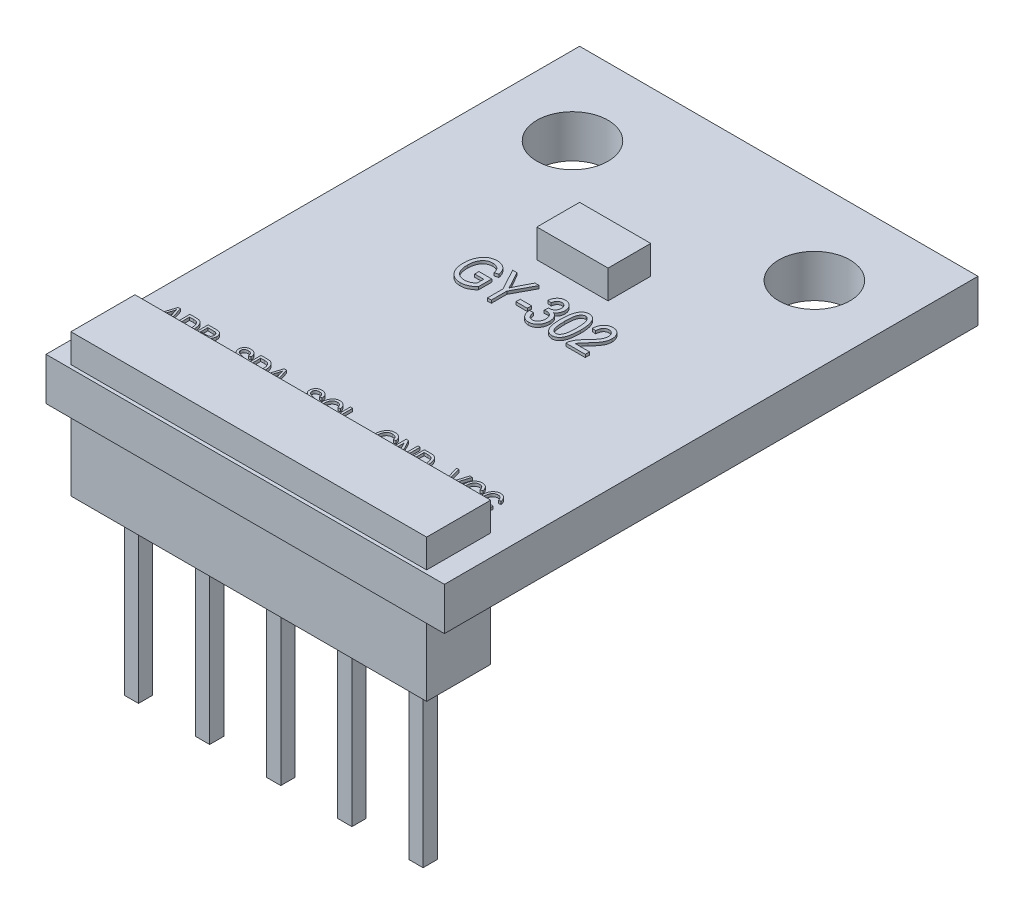
from build123d import *

# Parameters (mm, degrees)
SKETCH1_W           = 14
SKETCH1_H           = 18.75
SKETCH1_R           = 1.25
SKETCH1_W_2         = 12.5
SKETCH1_H_2         = 2.25
SKETCH1_W_3         = 2.5
SKETCH1_H_3         = 1.5
BOSS_EXTRUDE1_DEPTH = 1.5
SKETCH1_3_W         = 2.5
SKETCH1_3_H         = 1.5
BOSS_EXTRUDE2_DEPTH = 2.5
SKETCH1_4_W         = 12.5
SKETCH1_4_H         = 2.25
SKETCH1_4_W_2       = 0.5
SKETCH1_4_H_2       = 0.5
BOSS_EXTRUDE3_DEPTH = 2.5
SKETCH1_6_W         = 12.5
SKETCH1_6_H         = 2.25
SKETCH1_6_W_2       = 0.5
SKETCH1_6_H_2       = 0.5
BOSS_EXTRUDE4_DEPTH = 2.5
SKETCH1_7_W         = 0.5
SKETCH1_7_H         = 0.5
BOSS_EXTRUDE5_DEPTH = 8.5
LPATTERN1_COUNT     = 5
LPATTERN1_PITCH     = 2.5
BOSS_EXTRUDE6_START = 1.5
SKETCH2_W           = 0.400257457
SKETCH2_H           = 0.150096547
BOSS_EXTRUDE6_DEPTH = 0.1


with BuildPart() as part:
    # Sketch1 → Boss-Extrude1 (new body)
    with BuildSketch(Plane(origin=(0, 0, 0), x_dir=(1, 0, 0), z_dir=(0, 1, 0))):
        with Locations((0, 8.125)):
            Rectangle(SKETCH1_W, SKETCH1_H)
        with Locations(Location((-4.25, 14.5, 0), (0, 0, 270))):
            Circle(SKETCH1_R, mode=Mode.SUBTRACT)
        with Locations(Location((4.25, 14.5, 0), (0, 0, 270))):
            Circle(SKETCH1_R, mode=Mode.SUBTRACT)
        Rectangle(SKETCH1_W_2, SKETCH1_H_2, mode=Mode.SUBTRACT)
        with Locations((0, 11)):
            Rectangle(SKETCH1_W_3, SKETCH1_H_3, mode=Mode.SUBTRACT)
    extrude(amount=BOSS_EXTRUDE1_DEPTH)

    # Sketch1<3> → Boss-Extrude2 (add)
    with BuildSketch(Plane(origin=(0, 0, 0), x_dir=(1, 0, 0), z_dir=(0, 1, 0))):
        with Locations((0, 11)):
            Rectangle(SKETCH1_3_W, SKETCH1_3_H)
    extrude(amount=BOSS_EXTRUDE2_DEPTH)

    # Sketch1<4> → Boss-Extrude3 (add)
    # profile 1 of 2: a face of its own
    with BuildSketch(Plane(origin=(0, 0, 0), x_dir=(1, 0, 0), z_dir=(0, 1, 0))):
        Rectangle(SKETCH1_4_W, SKETCH1_4_H)
        with Locations((5, 0)):
            Rectangle(SKETCH1_4_W_2, SKETCH1_4_H_2, mode=Mode.SUBTRACT)
    # profile 2 of 2: a face of its own
    with BuildSketch(Plane(origin=(0, 0, 0), x_dir=(1, 0, 0), z_dir=(0, 1, 0))):
        with Locations((5, 0)):
            Rectangle(SKETCH1_4_W_2, SKETCH1_4_H_2)
    extrude(amount=BOSS_EXTRUDE3_DEPTH)

    # Sketch1<6> → Boss-Extrude4 (add)
    # profile 1 of 2: a face of its own
    with BuildSketch(Plane(origin=(0, 0, 0), x_dir=(1, 0, 0), z_dir=(0, 1, 0))):
        Rectangle(SKETCH1_6_W, SKETCH1_6_H)
        with Locations((5, 0)):
            Rectangle(SKETCH1_6_W_2, SKETCH1_6_H_2, mode=Mode.SUBTRACT)
    # profile 2 of 2: a face of its own
    with BuildSketch(Plane(origin=(0, 0, 0), x_dir=(1, 0, 0), z_dir=(0, 1, 0))):
        with Locations((5, 0)):
            Rectangle(SKETCH1_6_W_2, SKETCH1_6_H_2)
    extrude(amount=-BOSS_EXTRUDE4_DEPTH)

    # Sketch1<7> → Boss-Extrude5 (add)
    with BuildSketch(Plane(origin=(0, 0, 0), x_dir=(1, 0, 0), z_dir=(0, 1, 0))):
        with Locations((5, 0)):
            Rectangle(SKETCH1_7_W, SKETCH1_7_H)
    boss_extrude5 = extrude(amount=-BOSS_EXTRUDE5_DEPTH)

    # LPattern1: Boss-Extrude5 ×5
    with Locations(*[(-i * LPATTERN1_PITCH, 0, 0) for i in range(1, LPATTERN1_COUNT)]):
        add(boss_extrude5)

    # Sketch2 → Boss-Extrude6 (add)
    # profile 1 of 21: a face of its own
    with BuildSketch(Plane(origin=(0, 0, 0), x_dir=(1, 0, 0), z_dir=(0, 1, 0)).offset(BOSS_EXTRUDE6_START)):
        with BuildLine():
            Line((4.00813479, 1.625), (3.777674051, 2.395495605))
            Line((3.777674051, 2.395495605), (3.860070801, 2.395495605))
            Line((3.860070801, 2.395495605), (4.014232462, 1.83654232))
            add(Edge.make_bspline(
                [(4.014232462, 1.83654232), (4.017125559, 1.825865381), (4.02280561, 1.804903224), (4.030715903, 1.773914835), (4.038275252, 1.744129601), (4.042920069, 1.724601045), (4.045189875, 1.715057928)],
                knots=[0, 0, 0, 0, 1.058778416, 2.078711773, 3.061114545, 4, 4, 4, 4], degree=3))
            add(Edge.make_bspline(
                [(4.045189875, 1.715057928), (4.050333023, 1.735000076), (4.060831141, 1.775705698), (4.072837361, 1.815992487), (4.078961598, 1.83654232)],
                knots=[0, 0, 0, 0, 0.979822753, 2, 2, 2, 2], degree=3))
            Line((4.078961598, 1.83654232), (4.250321822, 2.395495605))
            Line((4.250321822, 2.395495605), (4.333500325, 2.395495605))
            Line((4.333500325, 2.395495605), (4.090844241, 1.625))
            Line((4.090844241, 1.625), (4.00813479, 1.625))
        make_face()
    # profile 2 of 21: a face of its own
    with BuildSketch(Plane(origin=(0, 0, 0), x_dir=(1, 0, 0), z_dir=(0, 1, 0)).offset(BOSS_EXTRUDE6_START)):
        with BuildLine():
            Line((4.860714444, 1.895173784), (4.940765936, 1.875160911))
            add(Edge.make_bspline(
                [(4.940765936, 1.875160911), (4.938379987, 1.864552619), (4.933728383, 1.843870875), (4.92500351, 1.814123771), (4.914808302, 1.786516148), (4.903421948, 1.760943418), (4.890753144, 1.737401658), (4.876864251, 1.715907061), (4.861638355, 1.696477196), (4.844999615, 1.679351326), (4.827503461, 1.663984886), (4.808742373, 1.651086251), (4.789280788, 1.639781778), (4.768746861, 1.630778254), (4.747347852, 1.623647041), (4.724968557, 1.618727596), (4.701699905, 1.615430965), (4.685821876, 1.615140566), (4.677784278, 1.614993564)],
                knots=[0, 0, 0, 0, 1.289221957, 2.51344498, 3.673011535, 4.776835723, 5.830430132, 6.840130389, 7.808269491, 8.7523986, 9.668123701, 10.564817631, 11.447926293, 12.333367568, 13.218722559, 14.118350969, 15.047492789, 16, 16, 16, 16], degree=3))
            add(Edge.make_bspline(
                [(4.677784278, 1.614993564), (4.670690426, 1.615091448), (4.656784811, 1.615283325), (4.636320781, 1.617452383), (4.616594282, 1.620620695), (4.597650983, 1.625390657), (4.579449155, 1.631230055), (4.562164536, 1.63872954), (4.545516267, 1.647264467), (4.529694897, 1.657351006), (4.514512458, 1.668777752), (4.5003764, 1.682063713), (4.486602948, 1.69658678), (4.473897924, 1.713040914), (4.461398903, 1.730770113), (4.450162112, 1.750437267), (4.439261084, 1.771466987), (4.429222133, 1.794028367), (4.419871521, 1.817894536), (4.412235542, 1.843100926), (4.405425112, 1.869208846), (4.400020012, 1.896420647), (4.395560344, 1.924623275), (4.39273622, 1.953969795), (4.390740183, 1.984318137), (4.390522572, 2.004928422), (4.390411932, 2.015407372)],
                knots=[0, 0, 0, 0, 0.921095259, 1.805562833, 2.670327692, 3.514278933, 4.340642213, 5.150451062, 5.958900505, 6.768369716, 7.58482939, 8.423223242, 9.285360719, 10.181948201, 11.120907027, 12.10087379, 13.121233649, 14.196976745, 15.307105309, 16.44839936, 17.61583717, 18.810746038, 20.050660639, 21.323136918, 22.638994396, 24, 24, 24, 24], degree=3))
            add(Edge.make_bspline(
                [(4.390411932, 2.015407372), (4.390521669, 2.025730074), (4.390736898, 2.045976111), (4.392729666, 2.075699794), (4.395546604, 2.104268188), (4.400021985, 2.131583237), (4.405390111, 2.157763803), (4.412175119, 2.182635648), (4.419925362, 2.206403394), (4.429141333, 2.228839744), (4.439526543, 2.249962577), (4.450624009, 2.269859786), (4.462459457, 2.288533176), (4.475303785, 2.305791456), (4.48908842, 2.321591775), (4.503701483, 2.336092362), (4.519218856, 2.349203028), (4.53546099, 2.361161013), (4.552481262, 2.371524908), (4.569928649, 2.380728626), (4.587934402, 2.388365232), (4.606432811, 2.394640552), (4.625405996, 2.399518539), (4.644861104, 2.402872391), (4.664749141, 2.405237946), (4.67819414, 2.40541349), (4.684976404, 2.405502042)],
                knots=[0, 0, 0, 0, 1.355009242, 2.657595594, 3.909622363, 5.12221665, 6.289669639, 7.416642245, 8.504963989, 9.569716403, 10.597874851, 11.593392335, 12.559484071, 13.498222117, 14.414780627, 15.309839368, 16.198178116, 17.079506653, 17.954919271, 18.811820418, 19.667108407, 20.519600343, 21.37423126, 22.235899437, 23.110108003, 24, 24, 24, 24], degree=3))
            add(Edge.make_bspline(
                [(4.684976404, 2.405502042), (4.692383614, 2.405310271), (4.706933888, 2.404933567), (4.728425313, 2.402295598), (4.748984273, 2.39749775), (4.768956596, 2.391316514), (4.787967481, 2.382960553), (4.806262558, 2.372907713), (4.823682259, 2.360946106), (4.840237958, 2.34714941), (4.855911681, 2.331688404), (4.870348393, 2.314401125), (4.883416304, 2.295364214), (4.895623282, 2.274844218), (4.906137025, 2.252340992), (4.915616578, 2.228250275), (4.924247482, 2.202530932), (4.928552377, 2.184565098), (4.930759499, 2.175354004)],
                knots=[0, 0, 0, 0, 0.969230344, 1.90389736, 2.827024372, 3.728538081, 4.635631584, 5.539103428, 6.456494714, 7.396000419, 8.355610671, 9.333534695, 10.338037519, 11.374284513, 12.454112223, 13.583699076, 14.761161004, 16, 16, 16, 16], degree=3))
            Line((4.930759499, 2.175354004), (4.850708008, 2.155341131))
            add(Edge.make_bspline(
                [(4.850708008, 2.155341131), (4.848898681, 2.161823913), (4.84536995, 2.174467284), (4.839090474, 2.19262702), (4.832222454, 2.20954686), (4.824758239, 2.225272484), (4.81644623, 2.239667434), (4.807529365, 2.252849016), (4.797992382, 2.264853925), (4.787634964, 2.275429029), (4.77680182, 2.284970726), (4.765160988, 2.293144676), (4.752809121, 2.299973255), (4.739857836, 2.305713506), (4.726266205, 2.3100312), (4.711989536, 2.313211498), (4.697065776, 2.3150874), (4.686857836, 2.315324269), (4.681693042, 2.315444114)],
                knots=[0, 0, 0, 0, 1.274827499, 2.486296693, 3.637698816, 4.732866786, 5.781146847, 6.783409552, 7.745577291, 8.681189198, 9.583979081, 10.476943643, 11.369744444, 12.253932728, 13.156290603, 14.066553906, 15.021756508, 16, 16, 16, 16], degree=3))
            add(Edge.make_bspline(
                [(4.681693042, 2.315444114), (4.671498759, 2.315066426), (4.651606161, 2.314329425), (4.622835436, 2.30819895), (4.596065901, 2.298393019), (4.575691483, 2.286626498), (4.560585064, 2.275340645), (4.549877369, 2.265692107), (4.539795137, 2.254920737), (4.530215631, 2.243129107), (4.521141411, 2.230220771), (4.512958381, 2.216038583), (4.505022298, 2.200984888), (4.497871039, 2.184738351), (4.491500228, 2.167388307), (4.485833772, 2.148972303), (4.481000899, 2.129457747), (4.477102475, 2.108785242), (4.474203871, 2.087013236), (4.471969063, 2.06412382), (4.470769063, 2.040123655), (4.470566554, 2.023747244), (4.470463423, 2.015407372)],
                knots=[0, 0, 0, 0, 1.477189771, 2.882511776, 4.245778241, 5.596752156, 6.277022015, 6.978177212, 7.684002091, 8.414723124, 9.180080371, 9.969542299, 10.787683758, 11.647234596, 12.541638645, 13.466905688, 14.440346501, 15.45581228, 16.516221105, 17.624831929, 18.790418795, 20, 20, 20, 20], degree=3))
            add(Edge.make_bspline(
                [(4.470463423, 2.015407372), (4.470661172, 2.002895404), (4.47104472, 1.978627518), (4.473490372, 1.943382633), (4.477769179, 1.910513201), (4.484050471, 1.880128794), (4.491809201, 1.852131641), (4.501248897, 1.826511029), (4.512727377, 1.803374526), (4.525840994, 1.782674001), (4.5404727, 1.764424394), (4.556259427, 1.748524089), (4.573300807, 1.735135529), (4.591389864, 1.724003323), (4.610795937, 1.715583076), (4.631246547, 1.709423812), (4.652898552, 1.705770076), (4.667711758, 1.705294536), (4.675282669, 1.705051491)],
                knots=[0, 0, 0, 0, 1.437104972, 2.787371166, 4.055570009, 5.241294904, 6.348053785, 7.389870239, 8.372351441, 9.308936623, 10.198930124, 11.053953419, 11.87666206, 12.682560998, 13.486679433, 14.299132302, 15.130700221, 16, 16, 16, 16], degree=3))
            add(Edge.make_bspline(
                [(4.675282669, 1.705051491), (4.680918937, 1.705206506), (4.692025819, 1.70551198), (4.708400405, 1.707793806), (4.724238996, 1.711322169), (4.739501457, 1.716500553), (4.754023413, 1.723326021), (4.768097899, 1.731272636), (4.781434138, 1.740956123), (4.794218603, 1.75197287), (4.806188332, 1.764573147), (4.817130798, 1.778743742), (4.827211076, 1.794369173), (4.835858651, 1.811707687), (4.843722155, 1.830395948), (4.850586557, 1.850606215), (4.856381517, 1.872338373), (4.85924691, 1.887439577), (4.860714444, 1.895173784)],
                knots=[0, 0, 0, 0, 0.928044623, 1.828813311, 2.717973564, 3.597468745, 4.476963925, 5.35746386, 6.25552913, 7.186585864, 8.133765821, 9.112470931, 10.131597503, 11.191133367, 12.299110282, 13.469062082, 14.703759174, 16, 16, 16, 16], degree=3))
        make_face()
    # profile 3 of 21: a face of its own
    with BuildSketch(Plane(origin=(0, 0, 0), x_dir=(1, 0, 0), z_dir=(0, 1, 0)).offset(BOSS_EXTRUDE6_START)):
        with BuildLine():
            Line((5.501126376, 1.895173784), (5.581177868, 1.875160911))
            add(Edge.make_bspline(
                [(5.581177868, 1.875160911), (5.578791919, 1.864552619), (5.574140315, 1.843870875), (5.565415441, 1.814123771), (5.555220234, 1.786516148), (5.54383388, 1.760943418), (5.531165076, 1.737401658), (5.517276182, 1.715907061), (5.502050287, 1.696477196), (5.485411547, 1.679351326), (5.467915393, 1.663984886), (5.449154305, 1.651086251), (5.42969272, 1.639781778), (5.409158793, 1.630778254), (5.387759784, 1.623647041), (5.365380489, 1.618727596), (5.342111837, 1.615430965), (5.326233808, 1.615140566), (5.31819621, 1.614993564)],
                knots=[0, 0, 0, 0, 1.289221957, 2.51344498, 3.673011535, 4.776835723, 5.830430132, 6.840130389, 7.808269491, 8.7523986, 9.668123701, 10.564817631, 11.447926293, 12.333367568, 13.218722559, 14.118350969, 15.047492789, 16, 16, 16, 16], degree=3))
            add(Edge.make_bspline(
                [(5.31819621, 1.614993564), (5.311102358, 1.615091448), (5.297196743, 1.615283325), (5.276732713, 1.617452383), (5.257006214, 1.620620695), (5.238062915, 1.625390657), (5.219861087, 1.631230055), (5.202576468, 1.63872954), (5.185928198, 1.647264467), (5.170106829, 1.657351006), (5.154924389, 1.668777752), (5.140788332, 1.682063713), (5.127014879, 1.69658678), (5.114309855, 1.713040914), (5.101810835, 1.730770113), (5.090574044, 1.750437267), (5.079673016, 1.771466987), (5.069634065, 1.794028367), (5.060283453, 1.817894536), (5.052647474, 1.843100926), (5.045837043, 1.869208846), (5.040431944, 1.896420647), (5.035972276, 1.924623275), (5.033148151, 1.953969795), (5.031152115, 1.984318137), (5.030934504, 2.004928422), (5.030823864, 2.015407372)],
                knots=[0, 0, 0, 0, 0.921095259, 1.805562833, 2.670327692, 3.514278933, 4.340642213, 5.150451062, 5.958900505, 6.768369716, 7.58482939, 8.423223242, 9.285360719, 10.181948201, 11.120907027, 12.10087379, 13.121233649, 14.196976745, 15.307105309, 16.44839936, 17.61583717, 18.810746038, 20.050660639, 21.323136918, 22.638994396, 24, 24, 24, 24], degree=3))
            add(Edge.make_bspline(
                [(5.030823864, 2.015407372), (5.030933601, 2.025730074), (5.03114883, 2.045976111), (5.033141597, 2.075699794), (5.035958535, 2.104268188), (5.040433917, 2.131583237), (5.045802042, 2.157763803), (5.052587051, 2.182635648), (5.060337294, 2.206403394), (5.069553265, 2.228839744), (5.079938474, 2.249962577), (5.091035941, 2.269859786), (5.102871389, 2.288533176), (5.115715716, 2.305791456), (5.129500352, 2.321591775), (5.144113415, 2.336092362), (5.159630788, 2.349203028), (5.175872922, 2.361161013), (5.192893194, 2.371524908), (5.21034058, 2.380728626), (5.228346334, 2.388365232), (5.246844743, 2.394640552), (5.265817927, 2.399518539), (5.285273035, 2.402872391), (5.305161073, 2.405237946), (5.318606072, 2.40541349), (5.325388336, 2.405502042)],
                knots=[0, 0, 0, 0, 1.355009242, 2.657595594, 3.909622363, 5.12221665, 6.289669639, 7.416642245, 8.504963989, 9.569716403, 10.597874851, 11.593392335, 12.559484071, 13.498222117, 14.414780627, 15.309839368, 16.198178116, 17.079506653, 17.954919271, 18.811820418, 19.667108407, 20.519600343, 21.37423126, 22.235899437, 23.110108003, 24, 24, 24, 24], degree=3))
            add(Edge.make_bspline(
                [(5.325388336, 2.405502042), (5.332795546, 2.405310271), (5.347345819, 2.404933567), (5.368837245, 2.402295598), (5.389396204, 2.39749775), (5.409368527, 2.391316514), (5.428379413, 2.382960553), (5.44667449, 2.372907713), (5.464094191, 2.360946106), (5.48064989, 2.34714941), (5.496323613, 2.331688404), (5.510760325, 2.314401125), (5.523828236, 2.295364214), (5.536035214, 2.274844218), (5.546548957, 2.252340992), (5.55602851, 2.228250275), (5.564659414, 2.202530932), (5.568964309, 2.184565098), (5.571171431, 2.175354004)],
                knots=[0, 0, 0, 0, 0.969230344, 1.90389736, 2.827024372, 3.728538081, 4.635631584, 5.539103428, 6.456494714, 7.396000419, 8.355610671, 9.333534695, 10.338037519, 11.374284513, 12.454112223, 13.583699076, 14.761161004, 16, 16, 16, 16], degree=3))
            Line((5.571171431, 2.175354004), (5.49111994, 2.155341131))
            add(Edge.make_bspline(
                [(5.49111994, 2.155341131), (5.489310613, 2.161823913), (5.485781882, 2.174467284), (5.479502406, 2.19262702), (5.472634386, 2.20954686), (5.465170171, 2.225272484), (5.456858162, 2.239667434), (5.447941297, 2.252849016), (5.438404314, 2.264853925), (5.428046896, 2.275429029), (5.417213752, 2.284970726), (5.40557292, 2.293144676), (5.393221053, 2.299973255), (5.380269768, 2.305713506), (5.366678137, 2.3100312), (5.352401468, 2.313211498), (5.337477708, 2.3150874), (5.327269768, 2.315324269), (5.322104974, 2.315444114)],
                knots=[0, 0, 0, 0, 1.274827499, 2.486296693, 3.637698816, 4.732866786, 5.781146847, 6.783409552, 7.745577291, 8.681189198, 9.583979081, 10.476943643, 11.369744444, 12.253932728, 13.156290603, 14.066553906, 15.021756508, 16, 16, 16, 16], degree=3))
            add(Edge.make_bspline(
                [(5.322104974, 2.315444114), (5.311910691, 2.315066426), (5.292018093, 2.314329425), (5.263247368, 2.30819895), (5.236477832, 2.298393019), (5.216103415, 2.286626498), (5.200996996, 2.275340645), (5.190289301, 2.265692107), (5.180207069, 2.254920737), (5.170627563, 2.243129107), (5.161553343, 2.230220771), (5.153370313, 2.216038583), (5.14543423, 2.200984888), (5.13828297, 2.184738351), (5.13191216, 2.167388307), (5.126245704, 2.148972303), (5.121412831, 2.129457747), (5.117514407, 2.108785242), (5.114615802, 2.087013236), (5.112380995, 2.06412382), (5.111180995, 2.040123655), (5.110978485, 2.023747244), (5.110875355, 2.015407372)],
                knots=[0, 0, 0, 0, 1.477189771, 2.882511776, 4.245778241, 5.596752156, 6.277022015, 6.978177212, 7.684002091, 8.414723124, 9.180080371, 9.969542299, 10.787683758, 11.647234596, 12.541638645, 13.466905688, 14.440346501, 15.45581228, 16.516221105, 17.624831929, 18.790418795, 20, 20, 20, 20], degree=3))
            add(Edge.make_bspline(
                [(5.110875355, 2.015407372), (5.111073104, 2.002895404), (5.111456652, 1.978627518), (5.113902304, 1.943382633), (5.118181111, 1.910513201), (5.124462403, 1.880128794), (5.132221133, 1.852131641), (5.141660828, 1.826511029), (5.153139309, 1.803374526), (5.166252926, 1.782674001), (5.180884632, 1.764424394), (5.196671359, 1.748524089), (5.213712739, 1.735135529), (5.231801796, 1.724003323), (5.251207869, 1.715583076), (5.271658479, 1.709423812), (5.293310483, 1.705770076), (5.30812369, 1.705294536), (5.315694601, 1.705051491)],
                knots=[0, 0, 0, 0, 1.437104972, 2.787371166, 4.055570009, 5.241294904, 6.348053785, 7.389870239, 8.372351441, 9.308936623, 10.198930124, 11.053953419, 11.87666206, 12.682560998, 13.486679433, 14.299132302, 15.130700221, 16, 16, 16, 16], degree=3))
            add(Edge.make_bspline(
                [(5.315694601, 1.705051491), (5.321330869, 1.705206506), (5.332437751, 1.70551198), (5.348812337, 1.707793806), (5.364650927, 1.711322169), (5.379913389, 1.716500553), (5.394435345, 1.723326021), (5.408509831, 1.731272636), (5.421846069, 1.740956123), (5.434630535, 1.75197287), (5.446600264, 1.764573147), (5.45754273, 1.778743742), (5.467623008, 1.794369173), (5.476270582, 1.811707687), (5.484134087, 1.830395948), (5.490998489, 1.850606215), (5.496793449, 1.872338373), (5.499658841, 1.887439577), (5.501126376, 1.895173784)],
                knots=[0, 0, 0, 0, 0.928044623, 1.828813311, 2.717973564, 3.597468745, 4.476963925, 5.35746386, 6.25552913, 7.186585864, 8.133765821, 9.112470931, 10.131597503, 11.191133367, 12.299110282, 13.469062082, 14.703759174, 16, 16, 16, 16], degree=3))
        make_face()
    # profile 4 of 21: a face of its own
    with BuildSketch(Plane(origin=(0, 0, 0), x_dir=(1, 0, 0), z_dir=(0, 1, 0)).offset(BOSS_EXTRUDE6_START)):
        with BuildLine():
            Line((1.620238148, 1.925193093), (1.620238148, 2.015251021))
            Line((1.620238148, 2.015251021), (1.890411932, 2.015251021))
            Line((1.890411932, 2.015251021), (1.890411932, 1.733038243))
            add(Edge.make_bspline(
                [(1.890411932, 1.733038243), (1.880137464, 1.723688774), (1.86002869, 1.705390368), (1.82797974, 1.681499619), (1.79553214, 1.660963741), (1.762511358, 1.644185364), (1.728976792, 1.631007358), (1.694949677, 1.621806229), (1.660404324, 1.616097556), (1.637197644, 1.615362411), (1.625554067, 1.614993564)],
                knots=[0, 0, 0, 0, 1.121144615, 2.194259096, 3.22291754, 4.218514423, 5.180530362, 6.126881594, 7.060193117, 8, 8, 8, 8], degree=3))
            add(Edge.make_bspline(
                [(1.625554067, 1.614993564), (1.617889506, 1.615171702), (1.602690626, 1.615524951), (1.580209201, 1.617491266), (1.558336859, 1.621164862), (1.537118442, 1.626127437), (1.516489398, 1.63251397), (1.496630255, 1.640642903), (1.477170443, 1.649727808), (1.458566234, 1.660607794), (1.440748406, 1.672782658), (1.423834464, 1.686281644), (1.40779101, 1.700967068), (1.392909108, 1.717230907), (1.378916244, 1.734711645), (1.365635215, 1.753350355), (1.353672632, 1.773531457), (1.342359316, 1.794838096), (1.332414057, 1.817474414), (1.323772101, 1.841245446), (1.316469594, 1.866113672), (1.310343663, 1.892093588), (1.305663761, 1.919193416), (1.302469428, 1.947386671), (1.300330005, 1.976651438), (1.300132593, 1.996537137), (1.300032182, 2.00665174)],
                knots=[0, 0, 0, 0, 0.963545397, 1.910717405, 2.833679837, 3.748938136, 4.648160849, 5.544707014, 6.44428759, 7.345417256, 8.250301349, 9.15471106, 10.063381295, 10.981308332, 11.922549023, 12.876762963, 13.855312354, 14.869185747, 15.907484256, 16.960251447, 18.046404778, 19.163470092, 20.313696906, 21.500864286, 22.728847097, 24, 24, 24, 24], degree=3))
            add(Edge.make_bspline(
                [(1.300032182, 2.00665174), (1.300136829, 2.016922195), (1.300342619, 2.037119279), (1.302427351, 2.066916499), (1.305852632, 2.095663606), (1.310569391, 2.123417825), (1.316402536, 2.150250308), (1.32397942, 2.175998508), (1.332694909, 2.200763349), (1.342751109, 2.224376806), (1.353736542, 2.246817518), (1.36581727, 2.267767508), (1.378590425, 2.287289638), (1.392459964, 2.305063296), (1.406781055, 2.321648921), (1.42216747, 2.336485843), (1.43831004, 2.349907449), (1.455442481, 2.361607232), (1.47330274, 2.371986598), (1.492006205, 2.380881428), (1.511413535, 2.38858133), (1.531622825, 2.394886303), (1.552675834, 2.399494501), (1.574497605, 2.402918943), (1.597100738, 2.405233859), (1.612466948, 2.405411967), (1.620238148, 2.405502042)],
                knots=[0, 0, 0, 0, 1.283121513, 2.523287582, 3.730023389, 4.899079804, 6.039789461, 7.15880579, 8.250410031, 9.318392136, 10.363902253, 11.370311636, 12.338384822, 13.276198214, 14.185288112, 15.074093801, 15.943727649, 16.805327304, 17.663128848, 18.522362821, 19.39060582, 20.270106898, 21.164311373, 22.080741752, 23.02936765, 24, 24, 24, 24], degree=3))
            add(Edge.make_bspline(
                [(1.620238148, 2.405502042), (1.631566121, 2.405232549), (1.653602717, 2.404708296), (1.685552014, 2.399758243), (1.715352169, 2.391699599), (1.742889098, 2.380182715), (1.768167783, 2.365744638), (1.791181497, 2.348588872), (1.811866859, 2.328718796), (1.826993632, 2.3098571), (1.837957353, 2.293359466), (1.845662733, 2.279765508), (1.852842227, 2.265104956), (1.859365994, 2.249245626), (1.865453387, 2.232338561), (1.871103289, 2.21436071), (1.876077437, 2.195244756), (1.878940304, 2.182087683), (1.880405495, 2.175354004)],
                knots=[0, 0, 0, 0, 1.421442541, 2.765168547, 4.047841273, 5.288586259, 6.501956771, 7.694182091, 8.88353085, 10.093491299, 10.721426975, 11.369099503, 12.053886711, 12.769643166, 13.521004755, 14.309514717, 15.134823968, 16, 16, 16, 16], degree=3))
            Line((1.880405495, 2.175354004), (1.800354004, 2.155341131))
            add(Edge.make_bspline(
                [(1.800354004, 2.155341131), (1.797740421, 2.165183094), (1.792819916, 2.183712226), (1.783630973, 2.209242398), (1.773399882, 2.230831464), (1.761961204, 2.248927668), (1.748818925, 2.263991724), (1.734262336, 2.277323534), (1.717455766, 2.288468376), (1.699211638, 2.298274657), (1.679311663, 2.305808251), (1.65823879, 2.311549198), (1.635872444, 2.314837574), (1.620561376, 2.315238919), (1.612733321, 2.315444114)],
                knots=[0, 0, 0, 0, 1.35370667, 2.548578037, 3.602482135, 4.525244969, 5.385205021, 6.25372376, 7.141792941, 8.059466754, 9.00287123, 9.96447941, 10.959304047, 12, 12, 12, 12], degree=3))
            add(Edge.make_bspline(
                [(1.612733321, 2.315444114), (1.606996724, 2.315368929), (1.595709653, 2.315220998), (1.579044817, 2.313604593), (1.563009833, 2.310977448), (1.547569783, 2.30730867), (1.532683164, 2.302932887), (1.518561558, 2.296972551), (1.504947507, 2.29030315), (1.491899686, 2.282615358), (1.479454458, 2.273835701), (1.467759115, 2.263762565), (1.456603988, 2.252692115), (1.446265297, 2.240272755), (1.436240754, 2.22696141), (1.427053461, 2.212312077), (1.418400574, 2.19661766), (1.410499735, 2.179788876), (1.403253847, 2.161918969), (1.397019814, 2.143068309), (1.391924606, 2.123189435), (1.387455224, 2.102455874), (1.384321218, 2.080656713), (1.381707721, 2.057936515), (1.380361646, 2.034238051), (1.380177277, 2.018118818), (1.380083674, 2.009935102)],
                knots=[0, 0, 0, 0, 0.95244652, 1.873991161, 2.777557121, 3.648832578, 4.508552549, 5.350797697, 6.190771618, 7.02501797, 7.86316154, 8.7165405, 9.585620601, 10.469996113, 11.397859992, 12.351132043, 13.338946381, 14.372712626, 15.436726846, 16.539770861, 17.66713286, 18.84353329, 20.060284837, 21.322933361, 22.640856277, 24, 24, 24, 24], degree=3))
            add(Edge.make_bspline(
                [(1.380083674, 2.009935102), (1.380290615, 1.997628229), (1.380692052, 1.97375469), (1.383870476, 1.939126393), (1.388897582, 1.906798165), (1.396221029, 1.876874073), (1.405597058, 1.849329072), (1.416987592, 1.824111578), (1.430600825, 1.801317831), (1.446347136, 1.781041537), (1.463751662, 1.763215072), (1.482439567, 1.747627058), (1.502364613, 1.734354918), (1.523696671, 1.723738074), (1.546122622, 1.715174036), (1.569899971, 1.709261559), (1.594912124, 1.705815666), (1.61199284, 1.705309653), (1.6207072, 1.705051491)],
                knots=[0, 0, 0, 0, 1.344305217, 2.607756079, 3.795613497, 4.915552292, 5.968887625, 6.970219091, 7.933010886, 8.862341374, 9.768284732, 10.649651063, 11.516609893, 12.377263757, 13.247581458, 14.134137142, 15.048060964, 16, 16, 16, 16], degree=3))
            add(Edge.make_bspline(
                [(1.6207072, 1.705051491), (1.629271692, 1.705321714), (1.64666579, 1.705870525), (1.6728299, 1.710453418), (1.699233938, 1.717902344), (1.72535631, 1.72794659), (1.750254451, 1.739954255), (1.773068614, 1.753161811), (1.79311061, 1.767677635), (1.804729968, 1.778572688), (1.81036044, 1.783852178)],
                knots=[0, 0, 0, 0, 0.978162575, 1.986604247, 3.025534994, 4.109442341, 5.180230685, 6.181206173, 7.118654505, 8, 8, 8, 8], degree=3))
            Line((1.81036044, 1.783852178), (1.81036044, 1.925193093))
            Line((1.81036044, 1.925193093), (1.620238148, 1.925193093))
        make_face()
    # profile 5 of 21: a face of its own
    with BuildSketch(Plane(origin=(0, 0, 0), x_dir=(1, 0, 0), z_dir=(0, 1, 0)).offset(BOSS_EXTRUDE6_START)):
        Polygon((2.010489169, 1.625), (2.010489169, 2.395495605), (2.095700229, 2.395495605), (2.420753063, 1.781350569), (2.420753063, 2.395495605), (2.500804554, 2.395495605), (2.500804554, 1.625), (2.415124442, 1.625), (2.090540661, 2.238363283), (2.090540661, 1.625), align=None)
    # profile 6 of 21: a face of its own
    with BuildSketch(Plane(origin=(0, 0, 0), x_dir=(1, 0, 0), z_dir=(0, 1, 0)).offset(BOSS_EXTRUDE6_START)):
        with BuildLine():
            Line((2.650901101, 1.625), (2.650901101, 2.395495605))
            Line((2.650901101, 2.395495605), (2.868072042, 2.395495605))
            add(Edge.make_bspline(
                [(2.868072042, 2.395495605), (2.874587842, 2.395497594), (2.887259879, 2.395501463), (2.905605599, 2.394617304), (2.92276387, 2.393587996), (2.938677451, 2.392065637), (2.953416054, 2.389958062), (2.966982123, 2.387787625), (2.979266826, 2.384739766), (2.986959894, 2.382393432), (2.990650888, 2.381267704)],
                knots=[0, 0, 0, 0, 1.26215185, 2.454654178, 3.557482523, 4.592303098, 5.550444389, 6.441834679, 7.252420792, 8, 8, 8, 8], degree=3))
            add(Edge.make_bspline(
                [(2.990650888, 2.381267704), (2.999634534, 2.377833682), (3.017608176, 2.370963213), (3.042548841, 2.355733029), (3.065519748, 2.336721386), (3.086695028, 2.314075912), (3.105680277, 2.287834236), (3.122631551, 2.258453247), (3.137130177, 2.225815938), (3.149488623, 2.190060776), (3.159327496, 2.15100029), (3.166252722, 2.108535328), (3.170499017, 2.06265989), (3.170984654, 2.030895732), (3.171235795, 2.014469268)],
                knots=[0, 0, 0, 0, 0.793557421, 1.587675775, 2.401718965, 3.251938517, 4.142780952, 5.072951786, 6.050439307, 7.089810771, 8.196152472, 9.375194853, 10.64261269, 12, 12, 12, 12], degree=3))
            add(Edge.make_bspline(
                [(3.171235795, 2.014469268), (3.171104187, 2.003783309), (3.170845292, 1.982762328), (3.169151999, 1.951875859), (3.166176239, 1.922192223), (3.162028192, 1.893791752), (3.156473366, 1.86663164), (3.150008282, 1.840651343), (3.142147349, 1.815931094), (3.133299328, 1.79253472), (3.123446048, 1.770621828), (3.112795045, 1.750291658), (3.10164118, 1.73151803), (3.089675499, 1.714474262), (3.076990047, 1.69913624), (3.063722978, 1.685320387), (3.049758061, 1.673141066), (3.034901169, 1.662802664), (3.019244138, 1.653722918), (3.002428122, 1.646152541), (2.984543732, 1.639491248), (2.965418044, 1.63428566), (2.945225729, 1.63001875), (2.9238572, 1.627082526), (2.901350571, 1.625382558), (2.885951083, 1.625129414), (2.878078478, 1.625)],
                knots=[0, 0, 0, 0, 1.386128034, 2.726734142, 4.010873419, 5.254715967, 6.447944792, 7.605518919, 8.725856033, 9.810649377, 10.848506109, 11.840315737, 12.786373227, 13.679144215, 14.538661634, 15.36577154, 16.161365935, 16.93783141, 17.710106602, 18.505700997, 19.327016474, 20.183204225, 21.074181726, 22.002513315, 22.978834581, 24, 24, 24, 24], degree=3))
            Line((2.878078478, 1.625), (2.650901101, 1.625))
        make_face()
        with BuildLine():
            Line((2.730952592, 1.715057928), (2.868384743, 1.715057928))
            add(Edge.make_bspline(
                [(2.868384743, 1.715057928), (2.875110265, 1.715151871), (2.888156288, 1.7153341), (2.907090723, 1.716623747), (2.92481241, 1.718530049), (2.941210551, 1.721630717), (2.956473627, 1.72497701), (2.970268134, 1.729879772), (2.983040625, 1.735037505), (2.994590561, 1.741399134), (3.005151086, 1.748708807), (3.01509556, 1.756811085), (3.02419167, 1.766197026), (3.032722334, 1.776470977), (3.040789645, 1.787657508), (3.048160546, 1.799867747), (3.054666758, 1.813230866), (3.058553938, 1.822554781), (3.060539592, 1.827317637)],
                knots=[0, 0, 0, 0, 1.342011219, 2.603204191, 3.786198351, 4.895972533, 5.932780973, 6.899736292, 7.813372447, 8.679106117, 9.524356621, 10.373947008, 11.234417048, 12.127941888, 13.037127478, 13.984247157, 14.970310281, 16, 16, 16, 16], degree=3))
            add(Edge.make_bspline(
                [(3.060539592, 1.827317637), (3.063010431, 1.834015399), (3.068021478, 1.847598965), (3.074265977, 1.868739559), (3.079312203, 1.890860934), (3.083827644, 1.913879061), (3.086939225, 1.937968713), (3.089550004, 1.962981516), (3.090909599, 1.988968866), (3.091091698, 2.006598318), (3.091184304, 2.015563722)],
                knots=[0, 0, 0, 0, 0.893165557, 1.811406971, 2.755792868, 3.73169534, 4.74530742, 5.793958353, 6.878124213, 8, 8, 8, 8], degree=3))
            add(Edge.make_bspline(
                [(3.091184304, 2.015563722), (3.09111599, 2.025103873), (3.090982995, 2.043676696), (3.089327768, 2.070740814), (3.086962694, 2.096220406), (3.083280807, 2.120099678), (3.078902212, 2.142436694), (3.073166428, 2.163180775), (3.066761644, 2.182438264), (3.058989428, 2.200030097), (3.050524665, 2.216106142), (3.041660197, 2.230915625), (3.03203906, 2.244254932), (3.021987042, 2.25637037), (3.011049726, 2.266834347), (2.999855391, 2.276199747), (2.987834988, 2.283936013), (2.979384801, 2.288059611), (2.975172182, 2.290115322)],
                knots=[0, 0, 0, 0, 1.456923081, 2.836346579, 4.140104769, 5.363837601, 6.525326372, 7.61445734, 8.64907664, 9.622216237, 10.547970715, 11.423056263, 12.255883474, 13.05801533, 13.823608501, 14.564597001, 15.284417456, 16, 16, 16, 16], degree=3))
            add(Edge.make_bspline(
                [(2.975172182, 2.290115322), (2.972116403, 2.291367203), (2.965686511, 2.29400138), (2.955145167, 2.297041528), (2.943396142, 2.299674731), (2.930408234, 2.301897355), (2.916139423, 2.303313096), (2.90061664, 2.304686383), (2.883813887, 2.305173742), (2.872189119, 2.305347892), (2.866195835, 2.305437678)],
                knots=[0, 0, 0, 0, 0.715245996, 1.505002602, 2.37361077, 3.324331965, 4.358357274, 5.480199528, 6.700887514, 8, 8, 8, 8], degree=3))
            Line((2.866195835, 2.305437678), (2.730952592, 2.305437678))
            Line((2.730952592, 2.305437678), (2.730952592, 1.715057928))
        make_face(mode=Mode.SUBTRACT)
    # profile 7 of 21: a face of its own
    with BuildSketch(Plane(origin=(0, 0, 0), x_dir=(1, 0, 0), z_dir=(0, 1, 0)).offset(BOSS_EXTRUDE6_START)):
        with BuildLine():
            Line((-1.199967818, 1.875160911), (-1.119916326, 1.885167347))
            add(Edge.make_bspline(
                [(-1.119916326, 1.885167347), (-1.11875073, 1.874976145), (-1.116540167, 1.855648452), (-1.110485807, 1.828581683), (-1.102388082, 1.805066225), (-1.09238387, 1.784628339), (-1.079563587, 1.76730393), (-1.064919518, 1.751723519), (-1.047670906, 1.738130942), (-1.028362729, 1.72626454), (-1.007110967, 1.716687388), (-0.98431029, 1.710069846), (-0.960282554, 1.705834412), (-0.943831728, 1.705316321), (-0.935422655, 1.705051491)],
                knots=[0, 0, 0, 0, 1.28056062, 2.428593037, 3.455857635, 4.381585452, 5.257863862, 6.137303782, 7.045121912, 7.991827123, 8.962072888, 9.946560163, 10.950355038, 12, 12, 12, 12], degree=3))
            add(Edge.make_bspline(
                [(-0.935422655, 1.705051491), (-0.929424262, 1.705173389), (-0.917766874, 1.705410288), (-0.900792368, 1.707192105), (-0.884804133, 1.709876202), (-0.869952517, 1.714051874), (-0.855961428, 1.718934888), (-0.843224732, 1.725444894), (-0.831305917, 1.732802142), (-0.820551139, 1.741367932), (-0.811067785, 1.7509956), (-0.80247178, 1.761099815), (-0.795482577, 1.772161446), (-0.789589074, 1.78374434), (-0.785267144, 1.796133649), (-0.781914936, 1.809082669), (-0.780046089, 1.822833372), (-0.779815509, 1.832211298), (-0.779697488, 1.837011372)],
                knots=[0, 0, 0, 0, 1.25000475, 2.42928239, 3.554432982, 4.624373226, 5.641561959, 6.637472043, 7.59895824, 8.557494333, 9.494616268, 10.412591127, 11.316575992, 12.215324116, 13.115580924, 14.045624415, 14.999656403, 16, 16, 16, 16], degree=3))
            add(Edge.make_bspline(
                [(-0.779697488, 1.837011372), (-0.779869579, 1.842547532), (-0.780204772, 1.853330628), (-0.783057813, 1.869027955), (-0.787922389, 1.883574793), (-0.794544822, 1.897082496), (-0.803097842, 1.909442591), (-0.813660551, 1.920594596), (-0.826211817, 1.930452402), (-0.838188135, 1.937928405), (-0.849757455, 1.943373624), (-0.860687911, 1.948067334), (-0.873851656, 1.95301842), (-0.889227361, 1.958347356), (-0.906819896, 1.963898958), (-0.926638955, 1.969847317), (-0.948615263, 1.976270416), (-0.964080328, 1.980512472), (-0.972165038, 1.982730103)],
                knots=[0, 0, 0, 0, 1.005239862, 1.957963033, 2.886140254, 3.783827184, 4.682063204, 5.60636897, 6.563082868, 7.574767638, 8.163399764, 8.884479363, 9.735568196, 10.717712603, 11.840607427, 13.08667948, 14.476996158, 16, 16, 16, 16], degree=3))
            add(Edge.make_bspline(
                [(-0.972165038, 1.982730103), (-0.979420521, 1.984777238), (-0.993402954, 1.988722384), (-1.013454138, 1.995036153), (-1.031924117, 2.001164818), (-1.048699045, 2.007703427), (-1.063989595, 2.013913199), (-1.07749475, 2.020577215), (-1.089421331, 2.027102381), (-1.103137445, 2.035758822), (-1.118118771, 2.047865669), (-1.133996899, 2.064043259), (-1.147867471, 2.081956689), (-1.159439975, 2.101604393), (-1.168825816, 2.122745125), (-1.175040833, 2.145533304), (-1.17937557, 2.169508744), (-1.179759392, 2.186017649), (-1.179954945, 2.194428773)],
                knots=[0, 0, 0, 0, 1.113815205, 2.146493548, 3.105946624, 3.988323839, 4.806360381, 5.543364066, 6.212027532, 6.814445107, 7.937696897, 9.048553401, 10.157540001, 11.276136463, 12.410655589, 13.563606105, 14.758681343, 16, 16, 16, 16], degree=3))
            add(Edge.make_bspline(
                [(-1.179954945, 2.194428773), (-1.179782388, 2.201995172), (-1.179443176, 2.216869188), (-1.176547391, 2.238639228), (-1.171957363, 2.259425217), (-1.165108132, 2.279005145), (-1.156728409, 2.297657873), (-1.146116318, 2.315009009), (-1.133845192, 2.331474361), (-1.119638056, 2.34666257), (-1.103990044, 2.36059175), (-1.086722147, 2.372563948), (-1.068198883, 2.382709202), (-1.048416381, 2.391281026), (-1.027192766, 2.397619395), (-1.004729785, 2.402080941), (-0.980997445, 2.405012767), (-0.964721354, 2.405336173), (-0.956373631, 2.405502042)],
                knots=[0, 0, 0, 0, 1.048547399, 2.061232895, 3.039277619, 3.994368589, 4.931972946, 5.868741773, 6.808014961, 7.774272834, 8.746911737, 9.706990873, 10.680354074, 11.670809819, 12.690200298, 13.744432806, 14.843158913, 16, 16, 16, 16], degree=3))
            add(Edge.make_bspline(
                [(-0.956373631, 2.405502042), (-0.944992911, 2.405184319), (-0.922786135, 2.404564358), (-0.890573726, 2.399379378), (-0.860575579, 2.39059538), (-0.832905735, 2.378372292), (-0.807780227, 2.362941486), (-0.785630002, 2.344209381), (-0.76630597, 2.322594917), (-0.750230223, 2.297865533), (-0.737219111, 2.27058663), (-0.727691643, 2.24087892), (-0.721480314, 2.208901914), (-0.720277282, 2.186744124), (-0.719658869, 2.175354004)],
                knots=[0, 0, 0, 0, 1.10297814, 2.152200164, 3.153123011, 4.125894755, 5.076644034, 6.001845166, 6.928824672, 7.877651763, 8.851800581, 9.850539915, 10.895078977, 12, 12, 12, 12], degree=3))
            Line((-0.719658869, 2.175354004), (-0.79971036, 2.165347567))
            add(Edge.make_bspline(
                [(-0.79971036, 2.165347567), (-0.800297601, 2.171509042), (-0.801442764, 2.183524394), (-0.804606867, 2.200809086), (-0.808650989, 2.216924822), (-0.813721286, 2.231783489), (-0.820092422, 2.245330057), (-0.827185894, 2.257718612), (-0.83544823, 2.268821142), (-0.844666478, 2.278698594), (-0.854941824, 2.287348404), (-0.866136727, 2.294929703), (-0.878346368, 2.301351275), (-0.891592457, 2.306469483), (-0.905702599, 2.310587747), (-0.920848509, 2.31332668), (-0.936945154, 2.315076504), (-0.94803015, 2.315319487), (-0.953715671, 2.315444114)],
                knots=[0, 0, 0, 0, 1.225165016, 2.389166377, 3.475498799, 4.513395989, 5.492249234, 6.435697439, 7.335638185, 8.226419293, 9.105162265, 9.989643781, 10.899061877, 11.830466535, 12.797276613, 13.805291738, 14.874328703, 16, 16, 16, 16], degree=3))
            add(Edge.make_bspline(
                [(-0.953715671, 2.315444114), (-0.959506783, 2.315394512), (-0.970700213, 2.315298639), (-0.986980267, 2.313407449), (-1.00222494, 2.310909803), (-1.016454923, 2.307106372), (-1.029547589, 2.302306349), (-1.041685087, 2.296445556), (-1.052702577, 2.289470144), (-1.062659721, 2.28142729), (-1.07137978, 2.272484011), (-1.079051014, 2.262972748), (-1.085611333, 2.252856733), (-1.090724449, 2.241983336), (-1.094807892, 2.230514241), (-1.097808969, 2.218426335), (-1.099518174, 2.205682748), (-1.099773319, 2.196987502), (-1.099903453, 2.192552567)],
                knots=[0, 0, 0, 0, 1.28677749, 2.487165856, 3.639785246, 4.719183444, 5.756778416, 6.736320351, 7.710431992, 8.649732596, 9.575714218, 10.482424581, 11.363216052, 12.249555033, 13.147559346, 14.066626488, 15.013899474, 16, 16, 16, 16], degree=3))
            add(Edge.make_bspline(
                [(-1.099903453, 2.192552567), (-1.099638204, 2.18460291), (-1.099133843, 2.169487007), (-1.094418595, 2.14819302), (-1.086570062, 2.129528649), (-1.0786099, 2.119341402), (-1.074731012, 2.114377282)],
                knots=[0, 0, 0, 0, 1.135097977, 2.158336086, 3.102579849, 4, 4, 4, 4], degree=3))
            add(Edge.make_bspline(
                [(-1.074731012, 2.114377282), (-1.07234936, 2.11200234), (-1.067176535, 2.10684409), (-1.057213851, 2.10034524), (-1.045354836, 2.093508234), (-1.030983303, 2.087307306), (-1.014623025, 2.08080546), (-0.99586093, 2.074844508), (-0.974934979, 2.068676895), (-0.960090368, 2.065014302), (-0.952308516, 2.063094295)],
                knots=[0, 0, 0, 0, 0.600125557, 1.303441474, 2.117395318, 3.047759802, 4.098473224, 5.265768101, 6.566659033, 8, 8, 8, 8], degree=3))
            add(Edge.make_bspline(
                [(-0.952308516, 2.063094295), (-0.944640728, 2.061244449), (-0.929907085, 2.057689972), (-0.908777877, 2.052146298), (-0.889366928, 2.047022112), (-0.87170307, 2.042114581), (-0.855908955, 2.037036858), (-0.841845093, 2.03232923), (-0.829431508, 2.02812532), (-0.82194683, 2.024885282), (-0.818472429, 2.023381251)],
                knots=[0, 0, 0, 0, 1.354590389, 2.602843464, 3.751324185, 4.802492375, 5.750771121, 6.599881396, 7.350062303, 8, 8, 8, 8], degree=3))
            add(Edge.make_bspline(
                [(-0.818472429, 2.023381251), (-0.809099436, 2.018847695), (-0.790926873, 2.010057938), (-0.766701987, 1.992828568), (-0.745954093, 1.973251233), (-0.729071134, 1.950891796), (-0.715746266, 1.926242825), (-0.706412647, 1.899206839), (-0.700636468, 1.869985288), (-0.699982277, 1.849755551), (-0.699645996, 1.83935663)],
                knots=[0, 0, 0, 0, 1.070280572, 2.075083192, 3.046573603, 3.996247495, 4.946860593, 5.919165523, 6.930365132, 8, 8, 8, 8], degree=3))
            add(Edge.make_bspline(
                [(-0.699645996, 1.83935663), (-0.699986049, 1.828906028), (-0.700657963, 1.808256599), (-0.706621573, 1.778052336), (-0.716365501, 1.749268599), (-0.729994614, 1.722372641), (-0.746673689, 1.697610184), (-0.766301337, 1.675644057), (-0.788965133, 1.657011496), (-0.81434694, 1.641626032), (-0.842448563, 1.62941844), (-0.873390836, 1.621192392), (-0.906939427, 1.615866746), (-0.930241241, 1.615291373), (-0.94230208, 1.614993564)],
                knots=[0, 0, 0, 0, 1.011281659, 1.998199493, 2.968653118, 3.946038549, 4.909179922, 5.852720419, 6.788493457, 7.73981833, 8.718701351, 9.744837575, 10.832745308, 12, 12, 12, 12], degree=3))
            add(Edge.make_bspline(
                [(-0.94230208, 1.614993564), (-0.951797269, 1.615192668), (-0.970325889, 1.615581194), (-0.9973287, 1.618926705), (-1.022828322, 1.624370039), (-1.046881551, 1.63204115), (-1.069524613, 1.641929299), (-1.090732707, 1.653989614), (-1.110400566, 1.668305917), (-1.128373327, 1.684777895), (-1.14462679, 1.703053795), (-1.158948666, 1.722981013), (-1.171063302, 1.744607469), (-1.18098421, 1.767756813), (-1.189053244, 1.792387551), (-1.194953688, 1.818555213), (-1.198725409, 1.846341622), (-1.199547167, 1.865403361), (-1.199967818, 1.875160911)],
                knots=[0, 0, 0, 0, 1.104995383, 2.156254069, 3.161771291, 4.136451373, 5.090038804, 6.032932257, 6.970972664, 7.915738022, 8.865457713, 9.813334699, 10.766787024, 11.745048075, 12.740780621, 13.779854267, 14.863525297, 16, 16, 16, 16], degree=3))
        make_face()
    # profile 8 of 21: a face of its own
    with BuildSketch(Plane(origin=(0, 0, 0), x_dir=(1, 0, 0), z_dir=(0, 1, 0)).offset(BOSS_EXTRUDE6_START)):
        with BuildLine():
            Line((-0.139285556, 1.895173784), (-0.059234064, 1.875160911))
            add(Edge.make_bspline(
                [(-0.059234064, 1.875160911), (-0.061620013, 1.864552619), (-0.066271617, 1.843870875), (-0.07499649, 1.814123771), (-0.085191698, 1.786516148), (-0.096578052, 1.760943418), (-0.109246856, 1.737401658), (-0.123135749, 1.715907061), (-0.138361645, 1.696477196), (-0.155000385, 1.679351326), (-0.172496539, 1.663984886), (-0.191257627, 1.651086251), (-0.210719212, 1.639781778), (-0.231253139, 1.630778254), (-0.252652148, 1.623647041), (-0.275031443, 1.618727596), (-0.298300095, 1.615430965), (-0.314178124, 1.615140566), (-0.322215722, 1.614993564)],
                knots=[0, 0, 0, 0, 1.289221957, 2.51344498, 3.673011535, 4.776835723, 5.830430132, 6.840130389, 7.808269491, 8.7523986, 9.668123701, 10.564817631, 11.447926293, 12.333367568, 13.218722559, 14.118350969, 15.047492789, 16, 16, 16, 16], degree=3))
            add(Edge.make_bspline(
                [(-0.322215722, 1.614993564), (-0.329309574, 1.615091448), (-0.343215189, 1.615283325), (-0.363679219, 1.617452383), (-0.383405718, 1.620620695), (-0.402349017, 1.625390657), (-0.420550845, 1.631230055), (-0.437835464, 1.63872954), (-0.454483733, 1.647264467), (-0.470305103, 1.657351006), (-0.485487542, 1.668777752), (-0.4996236, 1.682063713), (-0.513397052, 1.69658678), (-0.526102076, 1.713040914), (-0.538601097, 1.730770113), (-0.549837888, 1.750437267), (-0.560738916, 1.771466987), (-0.570777867, 1.794028367), (-0.580128479, 1.817894536), (-0.587764458, 1.843100926), (-0.594574888, 1.869208846), (-0.599979988, 1.896420647), (-0.604439656, 1.924623275), (-0.60726378, 1.953969795), (-0.609259817, 1.984318137), (-0.609477428, 2.004928422), (-0.609588068, 2.015407372)],
                knots=[0, 0, 0, 0, 0.921095259, 1.805562833, 2.670327692, 3.514278933, 4.340642213, 5.150451062, 5.958900505, 6.768369716, 7.58482939, 8.423223242, 9.285360719, 10.181948201, 11.120907027, 12.10087379, 13.121233649, 14.196976745, 15.307105309, 16.44839936, 17.61583717, 18.810746038, 20.050660639, 21.323136918, 22.638994396, 24, 24, 24, 24], degree=3))
            add(Edge.make_bspline(
                [(-0.609588068, 2.015407372), (-0.609478331, 2.025730074), (-0.609263102, 2.045976111), (-0.607270334, 2.075699794), (-0.604453396, 2.104268188), (-0.599978015, 2.131583237), (-0.594609889, 2.157763803), (-0.587824881, 2.182635648), (-0.580074638, 2.206403394), (-0.570858667, 2.228839744), (-0.560473457, 2.249962577), (-0.549375991, 2.269859786), (-0.537540543, 2.288533176), (-0.524696215, 2.305791456), (-0.51091158, 2.321591775), (-0.496298517, 2.336092362), (-0.480781144, 2.349203028), (-0.46453901, 2.361161013), (-0.447518738, 2.371524908), (-0.430071351, 2.380728626), (-0.412065598, 2.388365232), (-0.393567189, 2.394640552), (-0.374594004, 2.399518539), (-0.355138896, 2.402872391), (-0.335250859, 2.405237946), (-0.32180586, 2.40541349), (-0.315023596, 2.405502042)],
                knots=[0, 0, 0, 0, 1.355009242, 2.657595594, 3.909622363, 5.12221665, 6.289669639, 7.416642245, 8.504963989, 9.569716403, 10.597874851, 11.593392335, 12.559484071, 13.498222117, 14.414780627, 15.309839368, 16.198178116, 17.079506653, 17.954919271, 18.811820418, 19.667108407, 20.519600343, 21.37423126, 22.235899437, 23.110108003, 24, 24, 24, 24], degree=3))
            add(Edge.make_bspline(
                [(-0.315023596, 2.405502042), (-0.307616386, 2.405310271), (-0.293066112, 2.404933567), (-0.271574687, 2.402295598), (-0.251015727, 2.39749775), (-0.231043404, 2.391316514), (-0.212032519, 2.382960553), (-0.193737442, 2.372907713), (-0.176317741, 2.360946106), (-0.159762042, 2.34714941), (-0.144088319, 2.331688404), (-0.129651607, 2.314401125), (-0.116583696, 2.295364214), (-0.104376718, 2.274844218), (-0.093862975, 2.252340992), (-0.084383422, 2.228250275), (-0.075752518, 2.202530932), (-0.071447623, 2.184565098), (-0.069240501, 2.175354004)],
                knots=[0, 0, 0, 0, 0.969230344, 1.90389736, 2.827024372, 3.728538081, 4.635631584, 5.539103428, 6.456494714, 7.396000419, 8.355610671, 9.333534695, 10.338037519, 11.374284513, 12.454112223, 13.583699076, 14.761161004, 16, 16, 16, 16], degree=3))
            Line((-0.069240501, 2.175354004), (-0.149291992, 2.155341131))
            add(Edge.make_bspline(
                [(-0.149291992, 2.155341131), (-0.151101319, 2.161823913), (-0.15463005, 2.174467284), (-0.160909526, 2.19262702), (-0.167777546, 2.20954686), (-0.175241761, 2.225272484), (-0.18355377, 2.239667434), (-0.192470635, 2.252849016), (-0.202007618, 2.264853925), (-0.212365036, 2.275429029), (-0.22319818, 2.284970726), (-0.234839012, 2.293144676), (-0.247190879, 2.299973255), (-0.260142164, 2.305713506), (-0.273733795, 2.3100312), (-0.288010464, 2.313211498), (-0.302934224, 2.3150874), (-0.313142164, 2.315324269), (-0.318306958, 2.315444114)],
                knots=[0, 0, 0, 0, 1.274827499, 2.486296693, 3.637698816, 4.732866786, 5.781146847, 6.783409552, 7.745577291, 8.681189198, 9.583979081, 10.476943643, 11.369744444, 12.253932728, 13.156290603, 14.066553906, 15.021756508, 16, 16, 16, 16], degree=3))
            add(Edge.make_bspline(
                [(-0.318306958, 2.315444114), (-0.328501241, 2.315066426), (-0.348393839, 2.314329425), (-0.377164564, 2.30819895), (-0.403934099, 2.298393019), (-0.424308517, 2.286626498), (-0.439414936, 2.275340645), (-0.450122631, 2.265692107), (-0.460204863, 2.254920737), (-0.469784369, 2.243129107), (-0.478858589, 2.230220771), (-0.487041619, 2.216038583), (-0.494977702, 2.200984888), (-0.502128961, 2.184738351), (-0.508499772, 2.167388307), (-0.514166228, 2.148972303), (-0.518999101, 2.129457747), (-0.522897525, 2.108785242), (-0.525796129, 2.087013236), (-0.528030937, 2.06412382), (-0.529230937, 2.040123655), (-0.529433446, 2.023747244), (-0.529536577, 2.015407372)],
                knots=[0, 0, 0, 0, 1.477189771, 2.882511776, 4.245778241, 5.596752156, 6.277022015, 6.978177212, 7.684002091, 8.414723124, 9.180080371, 9.969542299, 10.787683758, 11.647234596, 12.541638645, 13.466905688, 14.440346501, 15.45581228, 16.516221105, 17.624831929, 18.790418795, 20, 20, 20, 20], degree=3))
            add(Edge.make_bspline(
                [(-0.529536577, 2.015407372), (-0.529338828, 2.002895404), (-0.52895528, 1.978627518), (-0.526509628, 1.943382633), (-0.522230821, 1.910513201), (-0.515949529, 1.880128794), (-0.508190799, 1.852131641), (-0.498751103, 1.826511029), (-0.487272623, 1.803374526), (-0.474159006, 1.782674001), (-0.4595273, 1.764424394), (-0.443740573, 1.748524089), (-0.426699193, 1.735135529), (-0.408610136, 1.724003323), (-0.389204063, 1.715583076), (-0.368753453, 1.709423812), (-0.347101448, 1.705770076), (-0.332288242, 1.705294536), (-0.324717331, 1.705051491)],
                knots=[0, 0, 0, 0, 1.437104972, 2.787371166, 4.055570009, 5.241294904, 6.348053785, 7.389870239, 8.372351441, 9.308936623, 10.198930124, 11.053953419, 11.87666206, 12.682560998, 13.486679433, 14.299132302, 15.130700221, 16, 16, 16, 16], degree=3))
            add(Edge.make_bspline(
                [(-0.324717331, 1.705051491), (-0.319081063, 1.705206506), (-0.307974181, 1.70551198), (-0.291599595, 1.707793806), (-0.275761004, 1.711322169), (-0.260498543, 1.716500553), (-0.245976587, 1.723326021), (-0.231902101, 1.731272636), (-0.218565862, 1.740956123), (-0.205781397, 1.75197287), (-0.193811668, 1.764573147), (-0.182869202, 1.778743742), (-0.172788924, 1.794369173), (-0.164141349, 1.811707687), (-0.156277845, 1.830395948), (-0.149413443, 1.850606215), (-0.143618483, 1.872338373), (-0.14075309, 1.887439577), (-0.139285556, 1.895173784)],
                knots=[0, 0, 0, 0, 0.928044623, 1.828813311, 2.717973564, 3.597468745, 4.476963925, 5.35746386, 6.25552913, 7.186585864, 8.133765821, 9.112470931, 10.131597503, 11.191133367, 12.299110282, 13.469062082, 14.703759174, 16, 16, 16, 16], degree=3))
        make_face()
    # profile 9 of 21: a face of its own
    with BuildSketch(Plane(origin=(0, 0, 0), x_dir=(1, 0, 0), z_dir=(0, 1, 0)).offset(BOSS_EXTRUDE6_START)):
        Polygon((0.050836737, 1.625), (0.050836737, 2.395495605), (0.130888228, 2.395495605), (0.130888228, 1.715057928), (0.451094194, 1.715057928), (0.451094194, 1.625), align=None)
    # profile 10 of 21: a face of its own
    with BuildSketch(Plane(origin=(0, 0, 0), x_dir=(1, 0, 0), z_dir=(0, 1, 0)).offset(BOSS_EXTRUDE6_START)):
        with BuildLine():
            Line((-3.699967818, 1.875160911), (-3.619916326, 1.885167347))
            add(Edge.make_bspline(
                [(-3.619916326, 1.885167347), (-3.61875073, 1.874976145), (-3.616540167, 1.855648452), (-3.610485807, 1.828581683), (-3.602388082, 1.805066225), (-3.59238387, 1.784628339), (-3.579563587, 1.76730393), (-3.564919518, 1.751723519), (-3.547670906, 1.738130942), (-3.528362729, 1.72626454), (-3.507110967, 1.716687388), (-3.48431029, 1.710069846), (-3.460282554, 1.705834412), (-3.443831728, 1.705316321), (-3.435422655, 1.705051491)],
                knots=[0, 0, 0, 0, 1.28056062, 2.428593037, 3.455857635, 4.381585452, 5.257863862, 6.137303782, 7.045121912, 7.991827123, 8.962072888, 9.946560163, 10.950355038, 12, 12, 12, 12], degree=3))
            add(Edge.make_bspline(
                [(-3.435422655, 1.705051491), (-3.429424262, 1.705173389), (-3.417766874, 1.705410288), (-3.400792368, 1.707192105), (-3.384804133, 1.709876202), (-3.369952517, 1.714051874), (-3.355961428, 1.718934888), (-3.343224732, 1.725444894), (-3.331305917, 1.732802142), (-3.320551139, 1.741367932), (-3.311067785, 1.7509956), (-3.30247178, 1.761099815), (-3.295482577, 1.772161446), (-3.289589074, 1.78374434), (-3.285267144, 1.796133649), (-3.281914936, 1.809082669), (-3.280046089, 1.822833372), (-3.279815509, 1.832211298), (-3.279697488, 1.837011372)],
                knots=[0, 0, 0, 0, 1.25000475, 2.42928239, 3.554432982, 4.624373226, 5.641561959, 6.637472043, 7.59895824, 8.557494333, 9.494616268, 10.412591127, 11.316575992, 12.215324116, 13.115580924, 14.045624415, 14.999656403, 16, 16, 16, 16], degree=3))
            add(Edge.make_bspline(
                [(-3.279697488, 1.837011372), (-3.279869579, 1.842547532), (-3.280204772, 1.853330628), (-3.283057813, 1.869027955), (-3.287922389, 1.883574793), (-3.294544822, 1.897082496), (-3.303097842, 1.909442591), (-3.313660551, 1.920594596), (-3.326211817, 1.930452402), (-3.338188135, 1.937928405), (-3.349757455, 1.943373624), (-3.360687911, 1.948067334), (-3.373851656, 1.95301842), (-3.389227361, 1.958347356), (-3.406819896, 1.963898958), (-3.426638955, 1.969847317), (-3.448615263, 1.976270416), (-3.464080328, 1.980512472), (-3.472165038, 1.982730103)],
                knots=[0, 0, 0, 0, 1.005239862, 1.957963033, 2.886140254, 3.783827184, 4.682063204, 5.60636897, 6.563082868, 7.574767638, 8.163399764, 8.884479363, 9.735568196, 10.717712603, 11.840607427, 13.08667948, 14.476996158, 16, 16, 16, 16], degree=3))
            add(Edge.make_bspline(
                [(-3.472165038, 1.982730103), (-3.479420521, 1.984777238), (-3.493402954, 1.988722384), (-3.513454138, 1.995036153), (-3.531924117, 2.001164818), (-3.548699045, 2.007703427), (-3.563989595, 2.013913199), (-3.57749475, 2.020577215), (-3.589421331, 2.027102381), (-3.603137445, 2.035758822), (-3.618118771, 2.047865669), (-3.633996899, 2.064043259), (-3.647867471, 2.081956689), (-3.659439975, 2.101604393), (-3.668825816, 2.122745125), (-3.675040833, 2.145533304), (-3.67937557, 2.169508744), (-3.679759392, 2.186017649), (-3.679954945, 2.194428773)],
                knots=[0, 0, 0, 0, 1.113815205, 2.146493548, 3.105946624, 3.988323839, 4.806360381, 5.543364066, 6.212027532, 6.814445107, 7.937696897, 9.048553401, 10.157540001, 11.276136463, 12.410655589, 13.563606105, 14.758681343, 16, 16, 16, 16], degree=3))
            add(Edge.make_bspline(
                [(-3.679954945, 2.194428773), (-3.679782388, 2.201995172), (-3.679443176, 2.216869188), (-3.676547391, 2.238639228), (-3.671957363, 2.259425217), (-3.665108132, 2.279005145), (-3.656728409, 2.297657873), (-3.646116318, 2.315009009), (-3.633845192, 2.331474361), (-3.619638056, 2.34666257), (-3.603990044, 2.36059175), (-3.586722147, 2.372563948), (-3.568198883, 2.382709202), (-3.548416381, 2.391281026), (-3.527192766, 2.397619395), (-3.504729785, 2.402080941), (-3.480997445, 2.405012767), (-3.464721354, 2.405336173), (-3.456373631, 2.405502042)],
                knots=[0, 0, 0, 0, 1.048547399, 2.061232895, 3.039277619, 3.994368589, 4.931972946, 5.868741773, 6.808014961, 7.774272834, 8.746911737, 9.706990873, 10.680354074, 11.670809819, 12.690200298, 13.744432806, 14.843158913, 16, 16, 16, 16], degree=3))
            add(Edge.make_bspline(
                [(-3.456373631, 2.405502042), (-3.444992911, 2.405184319), (-3.422786135, 2.404564358), (-3.390573726, 2.399379378), (-3.360575579, 2.39059538), (-3.332905735, 2.378372292), (-3.307780227, 2.362941486), (-3.285630002, 2.344209381), (-3.26630597, 2.322594917), (-3.250230223, 2.297865533), (-3.237219111, 2.27058663), (-3.227691643, 2.24087892), (-3.221480314, 2.208901914), (-3.220277282, 2.186744124), (-3.219658869, 2.175354004)],
                knots=[0, 0, 0, 0, 1.10297814, 2.152200164, 3.153123011, 4.125894755, 5.076644034, 6.001845166, 6.928824672, 7.877651763, 8.851800581, 9.850539915, 10.895078977, 12, 12, 12, 12], degree=3))
            Line((-3.219658869, 2.175354004), (-3.29971036, 2.165347567))
            add(Edge.make_bspline(
                [(-3.29971036, 2.165347567), (-3.300297601, 2.171509042), (-3.301442764, 2.183524394), (-3.304606867, 2.200809086), (-3.308650989, 2.216924822), (-3.313721286, 2.231783489), (-3.320092422, 2.245330057), (-3.327185894, 2.257718612), (-3.33544823, 2.268821142), (-3.344666478, 2.278698594), (-3.354941824, 2.287348404), (-3.366136727, 2.294929703), (-3.378346368, 2.301351275), (-3.391592457, 2.306469483), (-3.405702599, 2.310587747), (-3.420848509, 2.31332668), (-3.436945154, 2.315076504), (-3.44803015, 2.315319487), (-3.453715671, 2.315444114)],
                knots=[0, 0, 0, 0, 1.225165016, 2.389166377, 3.475498799, 4.513395989, 5.492249234, 6.435697439, 7.335638185, 8.226419293, 9.105162265, 9.989643781, 10.899061877, 11.830466535, 12.797276613, 13.805291738, 14.874328703, 16, 16, 16, 16], degree=3))
            add(Edge.make_bspline(
                [(-3.453715671, 2.315444114), (-3.459506783, 2.315394512), (-3.470700213, 2.315298639), (-3.486980267, 2.313407449), (-3.50222494, 2.310909803), (-3.516454923, 2.307106372), (-3.529547589, 2.302306349), (-3.541685087, 2.296445556), (-3.552702577, 2.289470144), (-3.562659721, 2.28142729), (-3.57137978, 2.272484011), (-3.579051014, 2.262972748), (-3.585611333, 2.252856733), (-3.590724449, 2.241983336), (-3.594807892, 2.230514241), (-3.597808969, 2.218426335), (-3.599518174, 2.205682748), (-3.599773319, 2.196987502), (-3.599903453, 2.192552567)],
                knots=[0, 0, 0, 0, 1.28677749, 2.487165856, 3.639785246, 4.719183444, 5.756778416, 6.736320351, 7.710431992, 8.649732596, 9.575714218, 10.482424581, 11.363216052, 12.249555033, 13.147559346, 14.066626488, 15.013899474, 16, 16, 16, 16], degree=3))
            add(Edge.make_bspline(
                [(-3.599903453, 2.192552567), (-3.599638204, 2.18460291), (-3.599133843, 2.169487007), (-3.594418595, 2.14819302), (-3.586570062, 2.129528649), (-3.5786099, 2.119341402), (-3.574731012, 2.114377282)],
                knots=[0, 0, 0, 0, 1.135097977, 2.158336086, 3.102579849, 4, 4, 4, 4], degree=3))
            add(Edge.make_bspline(
                [(-3.574731012, 2.114377282), (-3.57234936, 2.11200234), (-3.567176535, 2.10684409), (-3.557213851, 2.10034524), (-3.545354836, 2.093508234), (-3.530983303, 2.087307306), (-3.514623025, 2.08080546), (-3.49586093, 2.074844508), (-3.474934979, 2.068676895), (-3.460090368, 2.065014302), (-3.452308516, 2.063094295)],
                knots=[0, 0, 0, 0, 0.600125557, 1.303441474, 2.117395318, 3.047759802, 4.098473224, 5.265768101, 6.566659033, 8, 8, 8, 8], degree=3))
            add(Edge.make_bspline(
                [(-3.452308516, 2.063094295), (-3.444640728, 2.061244449), (-3.429907085, 2.057689972), (-3.408777877, 2.052146298), (-3.389366928, 2.047022112), (-3.37170307, 2.042114581), (-3.355908955, 2.037036858), (-3.341845093, 2.03232923), (-3.329431508, 2.02812532), (-3.32194683, 2.024885282), (-3.318472429, 2.023381251)],
                knots=[0, 0, 0, 0, 1.354590389, 2.602843464, 3.751324185, 4.802492375, 5.750771121, 6.599881396, 7.350062303, 8, 8, 8, 8], degree=3))
            add(Edge.make_bspline(
                [(-3.318472429, 2.023381251), (-3.309099436, 2.018847695), (-3.290926873, 2.010057938), (-3.266701987, 1.992828568), (-3.245954093, 1.973251233), (-3.229071134, 1.950891796), (-3.215746266, 1.926242825), (-3.206412647, 1.899206839), (-3.200636468, 1.869985288), (-3.199982277, 1.849755551), (-3.199645996, 1.83935663)],
                knots=[0, 0, 0, 0, 1.070280572, 2.075083192, 3.046573603, 3.996247495, 4.946860593, 5.919165523, 6.930365132, 8, 8, 8, 8], degree=3))
            add(Edge.make_bspline(
                [(-3.199645996, 1.83935663), (-3.199986049, 1.828906028), (-3.200657963, 1.808256599), (-3.206621573, 1.778052336), (-3.216365501, 1.749268599), (-3.229994614, 1.722372641), (-3.246673689, 1.697610184), (-3.266301337, 1.675644057), (-3.288965133, 1.657011496), (-3.31434694, 1.641626032), (-3.342448563, 1.62941844), (-3.373390836, 1.621192392), (-3.406939427, 1.615866746), (-3.430241241, 1.615291373), (-3.44230208, 1.614993564)],
                knots=[0, 0, 0, 0, 1.011281659, 1.998199493, 2.968653118, 3.946038549, 4.909179922, 5.852720419, 6.788493457, 7.73981833, 8.718701351, 9.744837575, 10.832745308, 12, 12, 12, 12], degree=3))
            add(Edge.make_bspline(
                [(-3.44230208, 1.614993564), (-3.451797269, 1.615192668), (-3.470325889, 1.615581194), (-3.4973287, 1.618926705), (-3.522828322, 1.624370039), (-3.546881551, 1.63204115), (-3.569524613, 1.641929299), (-3.590732707, 1.653989614), (-3.610400566, 1.668305917), (-3.628373327, 1.684777895), (-3.64462679, 1.703053795), (-3.658948666, 1.722981013), (-3.671063302, 1.744607469), (-3.68098421, 1.767756813), (-3.689053244, 1.792387551), (-3.694953688, 1.818555213), (-3.698725409, 1.846341622), (-3.699547167, 1.865403361), (-3.699967818, 1.875160911)],
                knots=[0, 0, 0, 0, 1.104995383, 2.156254069, 3.161771291, 4.136451373, 5.090038804, 6.032932257, 6.970972664, 7.915738022, 8.865457713, 9.813334699, 10.766787024, 11.745048075, 12.740780621, 13.779854267, 14.863525297, 16, 16, 16, 16], degree=3))
        make_face()
    # profile 11 of 21: a face of its own
    with BuildSketch(Plane(origin=(0, 0, 0), x_dir=(1, 0, 0), z_dir=(0, 1, 0)).offset(BOSS_EXTRUDE6_START)):
        with BuildLine():
            Line((-3.089575195, 1.625), (-3.089575195, 2.395495605))
            Line((-3.089575195, 2.395495605), (-2.872404255, 2.395495605))
            add(Edge.make_bspline(
                [(-2.872404255, 2.395495605), (-2.865888455, 2.395497594), (-2.853216417, 2.395501463), (-2.834870697, 2.394617304), (-2.817712427, 2.393587996), (-2.801798845, 2.392065637), (-2.787060243, 2.389958062), (-2.773494173, 2.387787625), (-2.761209471, 2.384739766), (-2.753516402, 2.382393432), (-2.749825408, 2.381267704)],
                knots=[0, 0, 0, 0, 1.26215185, 2.454654178, 3.557482523, 4.592303098, 5.550444389, 6.441834679, 7.252420792, 8, 8, 8, 8], degree=3))
            add(Edge.make_bspline(
                [(-2.749825408, 2.381267704), (-2.740841762, 2.377833682), (-2.72286812, 2.370963213), (-2.697927456, 2.355733029), (-2.674956548, 2.336721386), (-2.653781268, 2.314075912), (-2.634796019, 2.287834236), (-2.617844745, 2.258453247), (-2.603346119, 2.225815938), (-2.590987673, 2.190060776), (-2.5811488, 2.15100029), (-2.574223575, 2.108535328), (-2.569977279, 2.06265989), (-2.569491642, 2.030895732), (-2.569240501, 2.014469268)],
                knots=[0, 0, 0, 0, 0.793557421, 1.587675775, 2.401718965, 3.251938517, 4.142780952, 5.072951786, 6.050439307, 7.089810771, 8.196152472, 9.375194853, 10.64261269, 12, 12, 12, 12], degree=3))
            add(Edge.make_bspline(
                [(-2.569240501, 2.014469268), (-2.569372109, 2.003783309), (-2.569631004, 1.982762328), (-2.571324297, 1.951875859), (-2.574300057, 1.922192223), (-2.578448104, 1.893791752), (-2.58400293, 1.86663164), (-2.590468014, 1.840651343), (-2.598328947, 1.815931094), (-2.607176968, 1.79253472), (-2.617030248, 1.770621828), (-2.627681251, 1.750291658), (-2.638835116, 1.73151803), (-2.650800797, 1.714474262), (-2.663486249, 1.69913624), (-2.676753318, 1.685320387), (-2.690718236, 1.673141066), (-2.705575127, 1.662802664), (-2.721232158, 1.653722918), (-2.738048174, 1.646152541), (-2.755932564, 1.639491248), (-2.775058252, 1.63428566), (-2.795250567, 1.63001875), (-2.816619097, 1.627082526), (-2.839125725, 1.625382558), (-2.854525213, 1.625129414), (-2.862397818, 1.625)],
                knots=[0, 0, 0, 0, 1.386128034, 2.726734142, 4.010873419, 5.254715967, 6.447944792, 7.605518919, 8.725856033, 9.810649377, 10.848506109, 11.840315737, 12.786373227, 13.679144215, 14.538661634, 15.36577154, 16.161365935, 16.93783141, 17.710106602, 18.505700997, 19.327016474, 20.183204225, 21.074181726, 22.002513315, 22.978834581, 24, 24, 24, 24], degree=3))
            Line((-2.862397818, 1.625), (-3.089575195, 1.625))
        make_face()
        with BuildLine():
            Line((-3.009523704, 1.715057928), (-2.872091553, 1.715057928))
            add(Edge.make_bspline(
                [(-2.872091553, 1.715057928), (-2.865366031, 1.715151871), (-2.852320009, 1.7153341), (-2.833385573, 1.716623747), (-2.815663886, 1.718530049), (-2.799265745, 1.721630717), (-2.784002669, 1.72497701), (-2.770208162, 1.729879772), (-2.757435671, 1.735037505), (-2.745885735, 1.741399134), (-2.73532521, 1.748708807), (-2.725380736, 1.756811085), (-2.716284626, 1.766197026), (-2.707753963, 1.776470977), (-2.699686651, 1.787657508), (-2.69231575, 1.799867747), (-2.685809538, 1.813230866), (-2.681922358, 1.822554781), (-2.679936704, 1.827317637)],
                knots=[0, 0, 0, 0, 1.342011219, 2.603204191, 3.786198351, 4.895972533, 5.932780973, 6.899736292, 7.813372447, 8.679106117, 9.524356621, 10.373947008, 11.234417048, 12.127941888, 13.037127478, 13.984247157, 14.970310281, 16, 16, 16, 16], degree=3))
            add(Edge.make_bspline(
                [(-2.679936704, 1.827317637), (-2.677465865, 1.834015399), (-2.672454819, 1.847598965), (-2.666210319, 1.868739559), (-2.661164093, 1.890860934), (-2.656648652, 1.913879061), (-2.653537071, 1.937968713), (-2.650926292, 1.962981516), (-2.649566698, 1.988968866), (-2.649384598, 2.006598318), (-2.649291992, 2.015563722)],
                knots=[0, 0, 0, 0, 0.893165557, 1.811406971, 2.755792868, 3.73169534, 4.74530742, 5.793958353, 6.878124213, 8, 8, 8, 8], degree=3))
            add(Edge.make_bspline(
                [(-2.649291992, 2.015563722), (-2.649360307, 2.025103873), (-2.649493302, 2.043676696), (-2.651148528, 2.070740814), (-2.653513603, 2.096220406), (-2.657195489, 2.120099678), (-2.661574084, 2.142436694), (-2.667309868, 2.163180775), (-2.673714652, 2.182438264), (-2.681486869, 2.200030097), (-2.689951631, 2.216106142), (-2.6988161, 2.230915625), (-2.708437236, 2.244254932), (-2.718489255, 2.25637037), (-2.729426571, 2.266834347), (-2.740620905, 2.276199747), (-2.752641308, 2.283936013), (-2.761091495, 2.288059611), (-2.765304115, 2.290115322)],
                knots=[0, 0, 0, 0, 1.456923081, 2.836346579, 4.140104769, 5.363837601, 6.525326372, 7.61445734, 8.64907664, 9.622216237, 10.547970715, 11.423056263, 12.255883474, 13.05801533, 13.823608501, 14.564597001, 15.284417456, 16, 16, 16, 16], degree=3))
            add(Edge.make_bspline(
                [(-2.765304115, 2.290115322), (-2.768359893, 2.291367203), (-2.774789785, 2.29400138), (-2.78533113, 2.297041528), (-2.797080155, 2.299674731), (-2.810068062, 2.301897355), (-2.824336873, 2.303313096), (-2.839859656, 2.304686383), (-2.856662409, 2.305173742), (-2.868287177, 2.305347892), (-2.874280461, 2.305437678)],
                knots=[0, 0, 0, 0, 0.715245996, 1.505002602, 2.37361077, 3.324331965, 4.358357274, 5.480199528, 6.700887514, 8, 8, 8, 8], degree=3))
            Line((-2.874280461, 2.305437678), (-3.009523704, 2.305437678))
            Line((-3.009523704, 2.305437678), (-3.009523704, 1.715057928))
        make_face(mode=Mode.SUBTRACT)
    # profile 12 of 21: a face of its own
    with BuildSketch(Plane(origin=(0, 0, 0), x_dir=(1, 0, 0), z_dir=(0, 1, 0)).offset(BOSS_EXTRUDE6_START)):
        Polygon((-2.519208319, 1.625), (-2.273112522, 2.395495605), (-2.195093588, 2.395495605), (-1.948841442, 1.625), (-2.032019945, 1.625), (-2.09940704, 1.855148038), (-2.36864272, 1.855148038), (-2.435873465, 1.625), align=None)
        with BuildLine():
            Line((-2.342375825, 1.945205966), (-2.125830286, 1.945205966))
            Line((-2.125830286, 1.945205966), (-2.190246721, 2.156904637))
            add(Edge.make_bspline(
                [(-2.190246721, 2.156904637), (-2.192656556, 2.164822701), (-2.197361407, 2.180281568), (-2.204023906, 2.202918107), (-2.210418391, 2.22438844), (-2.215880513, 2.244842336), (-2.221311942, 2.264013669), (-2.22599618, 2.282115785), (-2.230201064, 2.299058843), (-2.232784068, 2.310021548), (-2.23402488, 2.315287763)],
                knots=[0, 0, 0, 0, 1.20859176, 2.359599242, 3.445754582, 4.479676267, 5.450859039, 6.355343929, 7.209947359, 8, 8, 8, 8], degree=3))
            add(Edge.make_bspline(
                [(-2.23402488, 2.315287763), (-2.23627749, 2.303021313), (-2.240779717, 2.278504707), (-2.249218964, 2.241982678), (-2.258607883, 2.205526555), (-2.266081116, 2.181475158), (-2.269829161, 2.169412682)],
                knots=[0, 0, 0, 0, 0.995500629, 1.989678841, 2.991765375, 4, 4, 4, 4], degree=3))
            Line((-2.269829161, 2.169412682), (-2.342375825, 1.945205966))
        make_face(mode=Mode.SUBTRACT)
    # profile 13 of 21: a face of its own
    with BuildSketch(Plane(origin=(0, 0, 0), x_dir=(1, 0, 0), z_dir=(0, 1, 0)).offset(BOSS_EXTRUDE6_START)):
        Polygon((-6.25, 1.625), (-6.003904204, 2.395495605), (-5.92588527, 2.395495605), (-5.679633123, 1.625), (-5.762811626, 1.625), (-5.830198721, 1.855148038), (-6.099434402, 1.855148038), (-6.166665147, 1.625), align=None)
        with BuildLine():
            Line((-6.073167506, 1.945205966), (-5.856621968, 1.945205966))
            Line((-5.856621968, 1.945205966), (-5.921038402, 2.156904637))
            add(Edge.make_bspline(
                [(-5.921038402, 2.156904637), (-5.923448237, 2.164822701), (-5.928153089, 2.180281568), (-5.934815587, 2.202918107), (-5.941210072, 2.22438844), (-5.946672194, 2.244842336), (-5.952103623, 2.264013669), (-5.956787861, 2.282115785), (-5.960992745, 2.299058843), (-5.963575749, 2.310021548), (-5.964816562, 2.315287763)],
                knots=[0, 0, 0, 0, 1.20859176, 2.359599242, 3.445754582, 4.479676267, 5.450859039, 6.355343929, 7.209947359, 8, 8, 8, 8], degree=3))
            add(Edge.make_bspline(
                [(-5.964816562, 2.315287763), (-5.967069171, 2.303021313), (-5.971571398, 2.278504707), (-5.980010646, 2.241982678), (-5.989399565, 2.205526555), (-5.996872798, 2.181475158), (-6.000620842, 2.169412682)],
                knots=[0, 0, 0, 0, 0.995500629, 1.989678841, 2.991765375, 4, 4, 4, 4], degree=3))
            Line((-6.000620842, 2.169412682), (-6.073167506, 1.945205966))
        make_face(mode=Mode.SUBTRACT)
    # profile 14 of 21: a face of its own
    with BuildSketch(Plane(origin=(0, 0, 0), x_dir=(1, 0, 0), z_dir=(0, 1, 0)).offset(BOSS_EXTRUDE6_START)):
        with BuildLine():
            Line((-5.589575195, 1.625), (-5.589575195, 2.395495605))
            Line((-5.589575195, 2.395495605), (-5.372404255, 2.395495605))
            add(Edge.make_bspline(
                [(-5.372404255, 2.395495605), (-5.365888455, 2.395497594), (-5.353216417, 2.395501463), (-5.334870697, 2.394617304), (-5.317712427, 2.393587996), (-5.301798845, 2.392065637), (-5.287060243, 2.389958062), (-5.273494173, 2.387787625), (-5.261209471, 2.384739766), (-5.253516402, 2.382393432), (-5.249825408, 2.381267704)],
                knots=[0, 0, 0, 0, 1.26215185, 2.454654178, 3.557482523, 4.592303098, 5.550444389, 6.441834679, 7.252420792, 8, 8, 8, 8], degree=3))
            add(Edge.make_bspline(
                [(-5.249825408, 2.381267704), (-5.240841762, 2.377833682), (-5.22286812, 2.370963213), (-5.197927456, 2.355733029), (-5.174956548, 2.336721386), (-5.153781268, 2.314075912), (-5.134796019, 2.287834236), (-5.117844745, 2.258453247), (-5.103346119, 2.225815938), (-5.090987673, 2.190060776), (-5.0811488, 2.15100029), (-5.074223575, 2.108535328), (-5.069977279, 2.06265989), (-5.069491642, 2.030895732), (-5.069240501, 2.014469268)],
                knots=[0, 0, 0, 0, 0.793557421, 1.587675775, 2.401718965, 3.251938517, 4.142780952, 5.072951786, 6.050439307, 7.089810771, 8.196152472, 9.375194853, 10.64261269, 12, 12, 12, 12], degree=3))
            add(Edge.make_bspline(
                [(-5.069240501, 2.014469268), (-5.069372109, 2.003783309), (-5.069631004, 1.982762328), (-5.071324297, 1.951875859), (-5.074300057, 1.922192223), (-5.078448104, 1.893791752), (-5.08400293, 1.86663164), (-5.090468014, 1.840651343), (-5.098328947, 1.815931094), (-5.107176968, 1.79253472), (-5.117030248, 1.770621828), (-5.127681251, 1.750291658), (-5.138835116, 1.73151803), (-5.150800797, 1.714474262), (-5.163486249, 1.69913624), (-5.176753318, 1.685320387), (-5.190718236, 1.673141066), (-5.205575127, 1.662802664), (-5.221232158, 1.653722918), (-5.238048174, 1.646152541), (-5.255932564, 1.639491248), (-5.275058252, 1.63428566), (-5.295250567, 1.63001875), (-5.316619097, 1.627082526), (-5.339125725, 1.625382558), (-5.354525213, 1.625129414), (-5.362397818, 1.625)],
                knots=[0, 0, 0, 0, 1.386128034, 2.726734142, 4.010873419, 5.254715967, 6.447944792, 7.605518919, 8.725856033, 9.810649377, 10.848506109, 11.840315737, 12.786373227, 13.679144215, 14.538661634, 15.36577154, 16.161365935, 16.93783141, 17.710106602, 18.505700997, 19.327016474, 20.183204225, 21.074181726, 22.002513315, 22.978834581, 24, 24, 24, 24], degree=3))
            Line((-5.362397818, 1.625), (-5.589575195, 1.625))
        make_face()
        with BuildLine():
            Line((-5.509523704, 1.715057928), (-5.372091553, 1.715057928))
            add(Edge.make_bspline(
                [(-5.372091553, 1.715057928), (-5.365366031, 1.715151871), (-5.352320009, 1.7153341), (-5.333385573, 1.716623747), (-5.315663886, 1.718530049), (-5.299265745, 1.721630717), (-5.284002669, 1.72497701), (-5.270208162, 1.729879772), (-5.257435671, 1.735037505), (-5.245885735, 1.741399134), (-5.23532521, 1.748708807), (-5.225380736, 1.756811085), (-5.216284626, 1.766197026), (-5.207753963, 1.776470977), (-5.199686651, 1.787657508), (-5.19231575, 1.799867747), (-5.185809538, 1.813230866), (-5.181922358, 1.822554781), (-5.179936704, 1.827317637)],
                knots=[0, 0, 0, 0, 1.342011219, 2.603204191, 3.786198351, 4.895972533, 5.932780973, 6.899736292, 7.813372447, 8.679106117, 9.524356621, 10.373947008, 11.234417048, 12.127941888, 13.037127478, 13.984247157, 14.970310281, 16, 16, 16, 16], degree=3))
            add(Edge.make_bspline(
                [(-5.179936704, 1.827317637), (-5.177465865, 1.834015399), (-5.172454819, 1.847598965), (-5.166210319, 1.868739559), (-5.161164093, 1.890860934), (-5.156648652, 1.913879061), (-5.153537071, 1.937968713), (-5.150926292, 1.962981516), (-5.149566698, 1.988968866), (-5.149384598, 2.006598318), (-5.149291992, 2.015563722)],
                knots=[0, 0, 0, 0, 0.893165557, 1.811406971, 2.755792868, 3.73169534, 4.74530742, 5.793958353, 6.878124213, 8, 8, 8, 8], degree=3))
            add(Edge.make_bspline(
                [(-5.149291992, 2.015563722), (-5.149360307, 2.025103873), (-5.149493302, 2.043676696), (-5.151148528, 2.070740814), (-5.153513603, 2.096220406), (-5.157195489, 2.120099678), (-5.161574084, 2.142436694), (-5.167309868, 2.163180775), (-5.173714652, 2.182438264), (-5.181486869, 2.200030097), (-5.189951631, 2.216106142), (-5.1988161, 2.230915625), (-5.208437236, 2.244254932), (-5.218489255, 2.25637037), (-5.229426571, 2.266834347), (-5.240620905, 2.276199747), (-5.252641308, 2.283936013), (-5.261091495, 2.288059611), (-5.265304115, 2.290115322)],
                knots=[0, 0, 0, 0, 1.456923081, 2.836346579, 4.140104769, 5.363837601, 6.525326372, 7.61445734, 8.64907664, 9.622216237, 10.547970715, 11.423056263, 12.255883474, 13.05801533, 13.823608501, 14.564597001, 15.284417456, 16, 16, 16, 16], degree=3))
            add(Edge.make_bspline(
                [(-5.265304115, 2.290115322), (-5.268359893, 2.291367203), (-5.274789785, 2.29400138), (-5.28533113, 2.297041528), (-5.297080155, 2.299674731), (-5.310068062, 2.301897355), (-5.324336873, 2.303313096), (-5.339859656, 2.304686383), (-5.356662409, 2.305173742), (-5.368287177, 2.305347892), (-5.374280461, 2.305437678)],
                knots=[0, 0, 0, 0, 0.715245996, 1.505002602, 2.37361077, 3.324331965, 4.358357274, 5.480199528, 6.700887514, 8, 8, 8, 8], degree=3))
            Line((-5.374280461, 2.305437678), (-5.509523704, 2.305437678))
            Line((-5.509523704, 2.305437678), (-5.509523704, 1.715057928))
        make_face(mode=Mode.SUBTRACT)
    # profile 15 of 21: a face of its own
    with BuildSketch(Plane(origin=(0, 0, 0), x_dir=(1, 0, 0), z_dir=(0, 1, 0)).offset(BOSS_EXTRUDE6_START)):
        with BuildLine():
            Line((-4.949163263, 1.625), (-4.949163263, 2.395495605))
            Line((-4.949163263, 2.395495605), (-4.666168733, 2.395495605))
            add(Edge.make_bspline(
                [(-4.666168733, 2.395495605), (-4.659027048, 2.395454497), (-4.645203582, 2.395374928), (-4.625178289, 2.394230275), (-4.606557897, 2.392535827), (-4.589367213, 2.390282873), (-4.573706592, 2.387159386), (-4.559513928, 2.383370373), (-4.546673758, 2.379141043), (-4.531599884, 2.372164723), (-4.514402504, 2.36134376), (-4.495855141, 2.344857476), (-4.479609164, 2.324441341), (-4.465152654, 2.300984009), (-4.453280521, 2.274646977), (-4.444870958, 2.245924845), (-4.439794271, 2.215194985), (-4.439160322, 2.194031676), (-4.438835005, 2.183171532)],
                knots=[0, 0, 0, 0, 0.957775898, 1.853873864, 2.6892683, 3.465319774, 4.178195347, 4.829309051, 5.435011313, 5.988660553, 7.053440284, 8.147710094, 9.30058322, 10.540256924, 11.835580405, 13.162637032, 14.543981594, 16, 16, 16, 16], degree=3))
            add(Edge.make_bspline(
                [(-4.438835005, 2.183171532), (-4.439005098, 2.175974794), (-4.439337343, 2.161917313), (-4.441349994, 2.141313638), (-4.444847516, 2.12176997), (-4.450196375, 2.10333688), (-4.456399741, 2.085785304), (-4.464545558, 2.069422913), (-4.473891331, 2.054038386), (-4.484753772, 2.039754004), (-4.496903811, 2.026601621), (-4.510539698, 2.014787976), (-4.525396296, 2.004145319), (-4.541589445, 1.994767099), (-4.559018928, 1.986533273), (-4.577890912, 1.979963029), (-4.597911271, 1.974209294), (-4.611837142, 1.971570186), (-4.618950861, 1.970222057)],
                knots=[0, 0, 0, 0, 1.121977975, 2.191573688, 3.224240956, 4.211948119, 5.180998842, 6.122125515, 7.055751929, 7.983633331, 8.914994346, 9.842128418, 10.791356962, 11.759862547, 12.75578979, 13.791489111, 14.871831714, 16, 16, 16, 16], degree=3))
            add(Edge.make_bspline(
                [(-4.618950861, 1.970222057), (-4.613700213, 1.967317001), (-4.603705017, 1.961786901), (-4.590026226, 1.952864615), (-4.57833613, 1.943883893), (-4.57172761, 1.937348511), (-4.568605978, 1.934261426)],
                knots=[0, 0, 0, 0, 1.158843086, 2.205987482, 3.152571606, 4, 4, 4, 4], degree=3))
            add(Edge.make_bspline(
                [(-4.568605978, 1.934261426), (-4.562362285, 1.926725038), (-4.549804688, 1.911567514), (-4.532590221, 1.887385586), (-4.51610103, 1.862229617), (-4.5064178, 1.84453369), (-4.501531584, 1.835604217)],
                knots=[0, 0, 0, 0, 0.982253192, 1.975551771, 2.978451105, 4, 4, 4, 4], degree=3))
            Line((-4.501531584, 1.835604217), (-4.388802823, 1.625))
            Line((-4.388802823, 1.625), (-4.479798854, 1.625))
            Line((-4.479798854, 1.625), (-4.568762328, 1.7897935))
            add(Edge.make_bspline(
                [(-4.568762328, 1.7897935), (-4.57290665, 1.79752045), (-4.580833749, 1.812300262), (-4.592598386, 1.833285414), (-4.60353444, 1.852210913), (-4.613623441, 1.869095216), (-4.623014906, 1.883759197), (-4.631449809, 1.896404362), (-4.639174613, 1.906886707), (-4.64841998, 1.917686688), (-4.659166218, 1.928881973), (-4.67194088, 1.940125548), (-4.684700706, 1.948841796), (-4.697691958, 1.955479501), (-4.711992536, 1.959852225), (-4.728106472, 1.963125264), (-4.746754555, 1.96490555), (-4.759975618, 1.96510999), (-4.76701485, 1.965218839)],
                knots=[0, 0, 0, 0, 1.483643366, 2.83785556, 4.070616892, 5.1822306, 6.165666296, 7.016844219, 7.754091418, 8.367230408, 9.421242841, 10.377779407, 11.241203819, 12.029974219, 12.835959019, 13.762973995, 14.808950166, 16, 16, 16, 16], degree=3))
            Line((-4.76701485, 1.965218839), (-4.869111772, 1.965218839))
            Line((-4.869111772, 1.965218839), (-4.869111772, 1.625))
            Line((-4.869111772, 1.625), (-4.949163263, 1.625))
        make_face()
        with BuildLine():
            Line((-4.869111772, 2.055276767), (-4.681334738, 2.055276767))
            add(Edge.make_bspline(
                [(-4.681334738, 2.055276767), (-4.671688104, 2.055464684), (-4.65360937, 2.055816859), (-4.628317226, 2.058155814), (-4.606729657, 2.06238844), (-4.588443427, 2.068553066), (-4.572850519, 2.076721405), (-4.559274851, 2.086836612), (-4.547367202, 2.098917083), (-4.537238475, 2.112890357), (-4.528863757, 2.128451282), (-4.523211498, 2.145557213), (-4.519374972, 2.163717757), (-4.519051973, 2.176271199), (-4.518886497, 2.182702481)],
                knots=[0, 0, 0, 0, 1.47306528, 2.760668081, 3.873497699, 4.82484281, 5.696997418, 6.550136397, 7.399890849, 8.276969651, 9.17766846, 10.086208714, 11.019541422, 12, 12, 12, 12], degree=3))
            add(Edge.make_bspline(
                [(-4.518886497, 2.182702481), (-4.51903102, 2.187343914), (-4.519312771, 2.19639251), (-4.520795183, 2.209611644), (-4.523688415, 2.222051208), (-4.527505856, 2.233778051), (-4.532638183, 2.244685033), (-4.538631527, 2.254944323), (-4.546179452, 2.264134123), (-4.554393354, 2.272834118), (-4.563899121, 2.280557728), (-4.574514541, 2.287250063), (-4.586237475, 2.292871745), (-4.598955373, 2.297692105), (-4.612926363, 2.300898441), (-4.627823017, 2.303675471), (-4.643830516, 2.305215088), (-4.654856403, 2.305361964), (-4.660540113, 2.305437678)],
                knots=[0, 0, 0, 0, 1.045235731, 2.037714497, 2.988326782, 3.915852726, 4.808207886, 5.697550021, 6.58254782, 7.478674216, 8.387536059, 9.331464042, 10.296946822, 11.310355404, 12.385965615, 13.518246496, 14.720686494, 16, 16, 16, 16], degree=3))
            Line((-4.660540113, 2.305437678), (-4.869111772, 2.305437678))
            Line((-4.869111772, 2.305437678), (-4.869111772, 2.055276767))
        make_face(mode=Mode.SUBTRACT)
    # profile 16 of 21: a face of its own
    with BuildSketch(Plane(origin=(0, 0, 0), x_dir=(1, 0, 0), z_dir=(0, 1, 0)).offset(BOSS_EXTRUDE6_START)):
        with BuildLine():
            Line((-1.81191211, 8.625321822), (-1.81191211, 8.775418368))
            Line((-1.81191211, 8.775418368), (-1.361622471, 8.775418368))
            Line((-1.361622471, 8.775418368), (-1.361622471, 8.305063739))
            add(Edge.make_bspline(
                [(-1.361622471, 8.305063739), (-1.378746584, 8.28948129), (-1.412261208, 8.258983947), (-1.465676125, 8.219166032), (-1.519755457, 8.184939569), (-1.574790093, 8.156975607), (-1.630681037, 8.135012264), (-1.687392895, 8.119677048), (-1.744968485, 8.110162594), (-1.783646284, 8.108937351), (-1.803052245, 8.108322606)],
                knots=[0, 0, 0, 0, 1.121144615, 2.194259096, 3.22291754, 4.218514423, 5.180530362, 6.126881594, 7.060193117, 8, 8, 8, 8], degree=3))
            add(Edge.make_bspline(
                [(-1.803052245, 8.108322606), (-1.815826514, 8.108619503), (-1.841157981, 8.109208251), (-1.878627022, 8.112485443), (-1.915080926, 8.118608104), (-1.950444954, 8.126879062), (-1.984826693, 8.137523284), (-2.017925266, 8.151071505), (-2.050358286, 8.166213013), (-2.081365301, 8.184346324), (-2.11106168, 8.204637763), (-2.139251584, 8.227136074), (-2.165990674, 8.25161178), (-2.190793844, 8.278718178), (-2.214115284, 8.307852742), (-2.236250331, 8.338917259), (-2.25618797, 8.372552429), (-2.275043497, 8.408063494), (-2.291618928, 8.44579069), (-2.306022189, 8.485409077), (-2.318193034, 8.526856119), (-2.328402919, 8.57015598), (-2.336202756, 8.615322359), (-2.341526644, 8.662311118), (-2.345092348, 8.71108573), (-2.345421368, 8.744228562), (-2.34558872, 8.761086233)],
                knots=[0, 0, 0, 0, 0.963545397, 1.910717405, 2.833679837, 3.748938136, 4.648160849, 5.544707014, 6.44428759, 7.345417256, 8.250301349, 9.15471106, 10.063381295, 10.981308332, 11.922549023, 12.876762963, 13.855312354, 14.869185747, 15.907484256, 16.960251447, 18.046404778, 19.163470092, 20.313696906, 21.500864286, 22.728847097, 24, 24, 24, 24], degree=3))
            add(Edge.make_bspline(
                [(-2.34558872, 8.761086233), (-2.345414309, 8.778203659), (-2.345071325, 8.811865466), (-2.341596773, 8.861527498), (-2.335887971, 8.909439343), (-2.328026705, 8.955696375), (-2.318304797, 9.00041718), (-2.305676657, 9.043330846), (-2.291150842, 9.084605581), (-2.274390509, 9.123961343), (-2.256081454, 9.161362531), (-2.235946908, 9.19627918), (-2.214658316, 9.228816063), (-2.191542418, 9.258438827), (-2.167673932, 9.286081535), (-2.142029907, 9.310809738), (-2.115125624, 9.333179082), (-2.086571555, 9.352678719), (-2.056804457, 9.369977664), (-2.025632015, 9.38480238), (-1.993286465, 9.39763555), (-1.959604315, 9.408143838), (-1.924515967, 9.415824169), (-1.88814635, 9.421531572), (-1.85047446, 9.425389764), (-1.824864111, 9.425686611), (-1.81191211, 9.425836737)],
                knots=[0, 0, 0, 0, 1.283121513, 2.523287582, 3.730023389, 4.899079804, 6.039789461, 7.15880579, 8.250410031, 9.318392136, 10.363902253, 11.370311636, 12.338384822, 13.276198214, 14.185288112, 15.074093801, 15.943727649, 16.805327304, 17.663128848, 18.522362821, 19.39060582, 20.270106898, 21.164311373, 22.080741752, 23.02936765, 24, 24, 24, 24], degree=3))
            add(Edge.make_bspline(
                [(-1.81191211, 9.425836737), (-1.793032155, 9.425387581), (-1.756304496, 9.424513827), (-1.703055668, 9.416263738), (-1.653388742, 9.402832665), (-1.607493861, 9.383637859), (-1.565362719, 9.359574397), (-1.52700653, 9.330981454), (-1.492530926, 9.29786466), (-1.467319636, 9.2664285), (-1.449046769, 9.238932443), (-1.436204468, 9.216275846), (-1.424238646, 9.191841594), (-1.413365701, 9.165409377), (-1.403220046, 9.137230935), (-1.393803542, 9.10726785), (-1.385513295, 9.075407927), (-1.38074185, 9.053479471), (-1.378299865, 9.042256673)],
                knots=[0, 0, 0, 0, 1.421442541, 2.765168547, 4.047841273, 5.288586259, 6.501956771, 7.694182091, 8.88353085, 10.093491299, 10.721426975, 11.369099503, 12.053886711, 12.769643166, 13.521004755, 14.309514717, 15.134823968, 16, 16, 16, 16], degree=3))
            Line((-1.378299865, 9.042256673), (-1.511719017, 9.008901885))
            add(Edge.make_bspline(
                [(-1.511719017, 9.008901885), (-1.516074989, 9.025305156), (-1.524275831, 9.056187043), (-1.539590735, 9.098737329), (-1.556642553, 9.134719106), (-1.575707018, 9.164879446), (-1.597610815, 9.189986206), (-1.621871796, 9.21220589), (-1.649882748, 9.230780627), (-1.680289627, 9.247124429), (-1.713456252, 9.259680419), (-1.748577707, 9.269248664), (-1.78585495, 9.274729289), (-1.811373398, 9.275398198), (-1.824420156, 9.27574019)],
                knots=[0, 0, 0, 0, 1.35370667, 2.548578037, 3.602482135, 4.525244969, 5.385205021, 6.25372376, 7.141792941, 8.059466754, 9.00287123, 9.96447941, 10.959304047, 12, 12, 12, 12], degree=3))
            add(Edge.make_bspline(
                [(-1.824420156, 9.27574019), (-1.833981151, 9.275614882), (-1.852792936, 9.275368331), (-1.880567663, 9.272674321), (-1.907292635, 9.268295747), (-1.933026052, 9.262181117), (-1.957837085, 9.254888146), (-1.981373094, 9.244954252), (-2.004063178, 9.233838583), (-2.025809546, 9.221025597), (-2.046551594, 9.206392835), (-2.066043832, 9.189604275), (-2.08463571, 9.171153524), (-2.101866863, 9.150454592), (-2.118574434, 9.128269016), (-2.133886589, 9.103853461), (-2.148308068, 9.0776961), (-2.161476132, 9.049648127), (-2.173552612, 9.019864949), (-2.183942668, 8.988447182), (-2.19243468, 8.955315725), (-2.19988365, 8.920759791), (-2.205106994, 8.884427855), (-2.209462822, 8.846560858), (-2.211706281, 8.807063418), (-2.212013562, 8.78019803), (-2.212169568, 8.766558503)],
                knots=[0, 0, 0, 0, 0.95244652, 1.873991161, 2.777557121, 3.648832578, 4.508552549, 5.350797697, 6.190771618, 7.02501797, 7.86316154, 8.7165405, 9.585620601, 10.469996113, 11.397859992, 12.351132043, 13.338946381, 14.372712626, 15.436726846, 16.539770861, 17.66713286, 18.84353329, 20.060284837, 21.322933361, 22.640856277, 24, 24, 24, 24], degree=3))
            add(Edge.make_bspline(
                [(-2.212169568, 8.766558503), (-2.211824665, 8.746047048), (-2.211155604, 8.706257817), (-2.205858231, 8.648543988), (-2.19747972, 8.594663608), (-2.185273976, 8.544790121), (-2.169647261, 8.498881786), (-2.150663038, 8.45685263), (-2.127974315, 8.418863052), (-2.101730464, 8.385069228), (-2.07272292, 8.355358454), (-2.041576413, 8.32937843), (-2.008368002, 8.307258197), (-1.972814573, 8.289563457), (-1.935437987, 8.275290061), (-1.895809073, 8.265435931), (-1.854122151, 8.259692776), (-1.825654291, 8.258849421), (-1.811130358, 8.258419152)],
                knots=[0, 0, 0, 0, 1.344305217, 2.607756079, 3.795613497, 4.915552292, 5.968887625, 6.970219091, 7.933010886, 8.862341374, 9.768284732, 10.649651063, 11.516609893, 12.377263757, 13.247581458, 14.134137142, 15.048060964, 16, 16, 16, 16], degree=3))
            add(Edge.make_bspline(
                [(-1.811130358, 8.258419152), (-1.796856204, 8.258869524), (-1.767866041, 8.259784208), (-1.72425919, 8.267422363), (-1.680252461, 8.279837239), (-1.636715174, 8.296577651), (-1.595218272, 8.316590425), (-1.557194667, 8.338603019), (-1.52379134, 8.362796059), (-1.504425744, 8.380954479), (-1.495041623, 8.389753631)],
                knots=[0, 0, 0, 0, 0.978162575, 1.986604247, 3.025534994, 4.109442341, 5.180230685, 6.181206173, 7.118654505, 8, 8, 8, 8], degree=3))
            Line((-1.495041623, 8.389753631), (-1.495041623, 8.625321822))
            Line((-1.495041623, 8.625321822), (-1.81191211, 8.625321822))
        make_face()
    # profile 17 of 21: a face of its own
    with BuildSketch(Plane(origin=(0, 0, 0), x_dir=(1, 0, 0), z_dir=(0, 1, 0)).offset(BOSS_EXTRUDE6_START)):
        with BuildLine():
            Line((-0.861300649, 8.125), (-0.861300649, 8.669099981))
            Line((-0.861300649, 8.669099981), (-1.261558106, 9.409159342))
            Line((-1.261558106, 9.409159342), (-1.111982728, 9.409159342))
            Line((-1.111982728, 9.409159342), (-0.897000696, 9.021670515))
            add(Edge.make_bspline(
                [(-0.897000696, 9.021670515), (-0.886591106, 9.002861031), (-0.866153495, 8.965931535), (-0.837256165, 8.910790764), (-0.810069606, 8.857271445), (-0.793212132, 8.821752705), (-0.784949454, 8.804343224)],
                knots=[0, 0, 0, 0, 1.054805564, 2.070946718, 3.054476075, 4, 4, 4, 4], degree=3))
            add(Edge.make_bspline(
                [(-0.784949454, 8.804343224), (-0.777115344, 8.821747981), (-0.760940916, 8.857682116), (-0.734442588, 8.912809079), (-0.705258928, 8.971013394), (-0.684749573, 9.010832328), (-0.674201134, 9.031312133)],
                knots=[0, 0, 0, 0, 0.906747811, 1.872085736, 2.905564156, 4, 4, 4, 4], degree=3))
            Line((-0.674201134, 9.031312133), (-0.476938833, 9.409159342))
            Line((-0.476938833, 9.409159342), (-0.327624039, 9.409159342))
            Line((-0.327624039, 9.409159342), (-0.727881497, 8.669099981))
            Line((-0.727881497, 8.669099981), (-0.727881497, 8.125))
            Line((-0.727881497, 8.125), (-0.861300649, 8.125))
        make_face()
    # profile 18 of 21: a face of its own
    with BuildSketch(Plane(origin=(0, 0, 0), x_dir=(1, 0, 0), z_dir=(0, 1, 0)).offset(BOSS_EXTRUDE6_START)):
        with Locations((-0.044108341, 8.583628337)):
            Rectangle(SKETCH2_W, SKETCH2_H)
    # profile 19 of 21: a face of its own
    with BuildSketch(Plane(origin=(0, 0, 0), x_dir=(1, 0, 0), z_dir=(0, 1, 0)).offset(BOSS_EXTRUDE6_START)):
        with BuildLine():
            Line((0.256084753, 8.475225275), (0.389503905, 8.491902669))
            add(Edge.make_bspline(
                [(0.389503905, 8.491902669), (0.391224647, 8.481806328), (0.394577744, 8.462132255), (0.401175151, 8.433820425), (0.408375598, 8.407327912), (0.416721077, 8.382904114), (0.425817892, 8.360310467), (0.435905647, 8.339691032), (0.44718413, 8.321049262), (0.459375726, 8.304374352), (0.472518091, 8.289587337), (0.486551442, 8.276785078), (0.501607207, 8.265976731), (0.517541865, 8.256981882), (0.534607578, 8.250309124), (0.552469035, 8.245216483), (0.571388678, 8.24238404), (0.584325262, 8.241958963), (0.590935555, 8.241741758)],
                knots=[0, 0, 0, 0, 1.392235382, 2.712957193, 3.95076201, 5.123471921, 6.220028287, 7.260520794, 8.240826993, 9.178593426, 10.065213643, 10.926376853, 11.755607984, 12.580369742, 13.407158359, 14.241002189, 15.101193065, 16, 16, 16, 16], degree=3))
            add(Edge.make_bspline(
                [(0.590935555, 8.241741758), (0.598165523, 8.241879324), (0.612376148, 8.242149712), (0.633200849, 8.246177799), (0.653433195, 8.25167705), (0.672724316, 8.260242342), (0.691413906, 8.270766911), (0.709525371, 8.283464602), (0.726346973, 8.299162038), (0.742727997, 8.316417594), (0.757836431, 8.335573865), (0.770863471, 8.356496727), (0.781834795, 8.378879512), (0.791041248, 8.402454526), (0.797629529, 8.427604972), (0.80305672, 8.453829622), (0.805779089, 8.481682817), (0.806215209, 8.500671092), (0.806438757, 8.510404153)],
                knots=[0, 0, 0, 0, 0.904038564, 1.776903143, 2.648138989, 3.525264603, 4.411852617, 5.332561374, 6.2875971, 7.288147468, 8.311042921, 9.337403868, 10.368883854, 11.429611823, 12.501164111, 13.621320171, 14.780729868, 16, 16, 16, 16], degree=3))
            add(Edge.make_bspline(
                [(0.806438757, 8.510404153), (0.806202452, 8.519530032), (0.805742373, 8.537297828), (0.803211875, 8.563287239), (0.798575397, 8.587909662), (0.791647811, 8.611097839), (0.783444255, 8.633208952), (0.772973076, 8.653791565), (0.760616458, 8.672963481), (0.74663692, 8.690588629), (0.731202789, 8.706473054), (0.714925601, 8.720611524), (0.69754144, 8.732361039), (0.679488368, 8.742254344), (0.660274068, 8.749365749), (0.640458469, 8.755026242), (0.619612125, 8.758152575), (0.605451035, 8.758542299), (0.598231915, 8.758740974)],
                knots=[0, 0, 0, 0, 1.208507307, 2.352925112, 3.453685551, 4.520081629, 5.553915499, 6.572344605, 7.570902253, 8.569592363, 9.545641393, 10.499968035, 11.418701314, 12.319183888, 13.218416966, 14.125267075, 15.044288268, 16, 16, 16, 16], degree=3))
            add(Edge.make_bspline(
                [(0.598231915, 8.758740974), (0.591703972, 8.758535531), (0.577788192, 8.758097582), (0.555875817, 8.754310164), (0.531625653, 8.748986989), (0.51498262, 8.743763418), (0.506245664, 8.741021243)],
                knots=[0, 0, 0, 0, 0.832645691, 1.774971563, 2.831945141, 4, 4, 4, 4], degree=3))
            Line((0.506245664, 8.741021243), (0.522923058, 8.892160127))
            Line((0.522923058, 8.892160127), (0.542988047, 8.890336037))
            add(Edge.make_bspline(
                [(0.542988047, 8.890336037), (0.550731057, 8.890423851), (0.565840287, 8.890595206), (0.587937823, 8.893761766), (0.609017143, 8.897957025), (0.628864977, 8.904324124), (0.647722587, 8.912151017), (0.66529617, 8.922071842), (0.681906333, 8.933639819), (0.697256075, 8.946855506), (0.711035682, 8.961796399), (0.723345092, 8.977835705), (0.73351987, 8.995224112), (0.741974684, 9.01362156), (0.748457573, 9.033293946), (0.753188723, 9.054137916), (0.755703447, 9.076245493), (0.756168188, 9.091327701), (0.756406575, 9.099064047)],
                knots=[0, 0, 0, 0, 1.104467345, 2.155189185, 3.181695374, 4.170183668, 5.126157628, 6.092295424, 7.04536858, 8.012620263, 8.977961638, 9.942904556, 10.893715412, 11.848320646, 12.828840281, 13.845861792, 14.895045293, 16, 16, 16, 16], degree=3))
            add(Edge.make_bspline(
                [(0.756406575, 9.099064047), (0.755808592, 9.112921931), (0.754659375, 9.139554305), (0.745837825, 9.177486569), (0.730465874, 9.211062535), (0.709304432, 9.239769181), (0.683839355, 9.262902166), (0.655391847, 9.28023785), (0.623842691, 9.290509281), (0.601866892, 9.291773658), (0.590674971, 9.292417584)],
                knots=[0, 0, 0, 0, 1.168747258, 2.246123166, 3.262822778, 4.26410748, 5.234436762, 6.148309006, 7.056963545, 8, 8, 8, 8], degree=3))
            add(Edge.make_bspline(
                [(0.590674971, 9.292417584), (0.579045553, 9.291876867), (0.556422305, 9.290824984), (0.524072523, 9.28079047), (0.494310339, 9.265418741), (0.472614921, 9.246930427), (0.457240578, 9.229425938), (0.446392826, 9.214675548), (0.43675365, 9.198273279), (0.428584381, 9.180072673), (0.420721906, 9.160576183), (0.415161465, 9.139118684), (0.409607503, 9.116354131), (0.407347544, 9.100480431), (0.406181299, 9.092288855)],
                knots=[0, 0, 0, 0, 1.389180941, 2.702438466, 4.019316734, 5.377896697, 6.085434137, 6.807430375, 7.567469407, 8.358691296, 9.195188439, 10.081130764, 11.009773198, 12, 12, 12, 12], degree=3))
            Line((0.406181299, 9.092288855), (0.272762147, 9.108966249))
            add(Edge.make_bspline(
                [(0.272762147, 9.108966249), (0.274946798, 9.121680481), (0.279208399, 9.14648215), (0.288111881, 9.182170385), (0.298708204, 9.215510568), (0.31153781, 9.246319109), (0.326105249, 9.274863469), (0.342586953, 9.301023188), (0.360768247, 9.32497001), (0.381280774, 9.346042524), (0.403082135, 9.36481075), (0.426184994, 9.381019337), (0.450177442, 9.394970602), (0.475454931, 9.406209981), (0.50178011, 9.415122285), (0.529284789, 9.421359047), (0.557827643, 9.425046008), (0.577200639, 9.425570639), (0.587026791, 9.425836737)],
                knots=[0, 0, 0, 0, 1.259750421, 2.457396855, 3.589696629, 4.673763457, 5.713494597, 6.716289503, 7.690389722, 8.644478697, 9.583164327, 10.496506905, 11.397350125, 12.289843847, 13.194037124, 14.107891875, 15.040306322, 16, 16, 16, 16], degree=3))
            add(Edge.make_bspline(
                [(0.587026791, 9.425836737), (0.59738036, 9.42553133), (0.617749427, 9.42493049), (0.647687687, 9.420320292), (0.676480131, 9.413134524), (0.704050103, 9.402658116), (0.730152547, 9.388858157), (0.755430421, 9.372675928), (0.779457509, 9.353287692), (0.801857244, 9.33101021), (0.822418197, 9.306632366), (0.840452353, 9.280439709), (0.855942073, 9.252874428), (0.868241983, 9.22353721), (0.877856054, 9.192724229), (0.884881431, 9.160385375), (0.889183338, 9.126455036), (0.889608348, 9.103333205), (0.889825727, 9.091507103)],
                knots=[0, 0, 0, 0, 0.987546189, 1.94284647, 2.883618689, 3.814886987, 4.749064414, 5.696240478, 6.674807358, 7.688712876, 8.706405422, 9.713376545, 10.718845743, 11.717906576, 12.742863162, 13.794678478, 14.872046121, 16, 16, 16, 16], degree=3))
            add(Edge.make_bspline(
                [(0.889825727, 9.091507103), (0.889424317, 9.077227568), (0.88864037, 9.049339847), (0.881083938, 9.008886355), (0.869091902, 8.970934066), (0.852365971, 8.935735419), (0.831523513, 8.903471251), (0.806489117, 8.874931723), (0.777918231, 8.849634499), (0.756194186, 8.836344742), (0.74520145, 8.829619899)],
                knots=[0, 0, 0, 0, 1.090109576, 2.128968013, 3.132278696, 4.123864162, 5.09769889, 6.057339906, 7.016980922, 8, 8, 8, 8], degree=3))
            add(Edge.make_bspline(
                [(0.74520145, 8.829619899), (0.755298996, 8.82651299), (0.775028319, 8.820442484), (0.802246409, 8.806772012), (0.827064665, 8.790896347), (0.849240229, 8.771854155), (0.868963209, 8.74963899), (0.886574552, 8.724096599), (0.901705889, 8.694982863), (0.915376283, 8.663023416), (0.926089357, 8.628241018), (0.934320133, 8.59133108), (0.938987499, 8.55230473), (0.939563379, 8.525616964), (0.939857909, 8.511967659)],
                knots=[0, 0, 0, 0, 0.945190562, 1.846782401, 2.71900073, 3.580139159, 4.456653473, 5.37426406, 6.352713278, 7.392141409, 8.485180558, 9.608884637, 10.777077804, 12, 12, 12, 12], degree=3))
            add(Edge.make_bspline(
                [(0.939857909, 8.511967659), (0.939602356, 8.497445331), (0.939103438, 8.469093253), (0.933885917, 8.427537712), (0.925989535, 8.388012996), (0.91472548, 8.350377822), (0.900169771, 8.314923356), (0.88219447, 8.281446841), (0.861178636, 8.249944812), (0.836982304, 8.220859095), (0.810525042, 8.194817202), (0.78280086, 8.171545292), (0.753600436, 8.152022026), (0.723172472, 8.135893208), (0.691380874, 8.123645673), (0.658395766, 8.114694623), (0.624026312, 8.109407855), (0.600682078, 8.108687628), (0.588850881, 8.108322606)],
                knots=[0, 0, 0, 0, 1.16797173, 2.280242353, 3.364490462, 4.408173669, 5.436152277, 6.443028727, 7.460738993, 8.478233232, 9.481512989, 10.444418881, 11.386528098, 12.302557467, 13.209825675, 14.12198051, 15.04819242, 16, 16, 16, 16], degree=3))
            add(Edge.make_bspline(
                [(0.588850881, 8.108322606), (0.577888779, 8.108612072), (0.556295782, 8.109182257), (0.524593455, 8.114024999), (0.494173394, 8.121797247), (0.465150005, 8.13288232), (0.437184278, 8.14674437), (0.410709643, 8.164004688), (0.385396558, 8.184336866), (0.361611219, 8.207601971), (0.339876074, 8.233645044), (0.320134343, 8.261721945), (0.302794134, 8.291980822), (0.288679197, 8.324717877), (0.276600072, 8.359278274), (0.266939672, 8.395937469), (0.25985529, 8.434798604), (0.257359058, 8.461562517), (0.256084753, 8.475225275)],
                knots=[0, 0, 0, 0, 0.959274814, 1.889566238, 2.800731978, 3.703256649, 4.604498869, 5.528396462, 6.464265966, 7.442996794, 8.436156864, 9.429840861, 10.444772988, 11.483305447, 12.546329121, 13.647537524, 14.799087218, 16, 16, 16, 16], degree=3))
        make_face()
    # profile 20 of 21: a face of its own
    with BuildSketch(Plane(origin=(0, 0, 0), x_dir=(1, 0, 0), z_dir=(0, 1, 0)).offset(BOSS_EXTRUDE6_START)):
        with BuildLine():
            add(Edge.make_bspline(
                [(1.073277062, 8.766558503), (1.073488927, 8.792796624), (1.073900318, 8.843744747), (1.078151957, 8.917639229), (1.08485805, 8.986673093), (1.093977432, 9.050753771), (1.106319441, 9.109890884), (1.12085339, 9.164179308), (1.138703977, 9.213446402), (1.158795915, 9.257903418), (1.181836748, 9.297302123), (1.207238292, 9.331777902), (1.235754049, 9.360771215), (1.266597731, 9.384880284), (1.300382933, 9.403247174), (1.336628785, 9.416447085), (1.375469276, 9.424412449), (1.402270574, 9.425355542), (1.415945393, 9.425836737)],
                knots=[0, 0, 0, 0, 1.522295809, 2.955932353, 4.292935845, 5.545987552, 6.709403679, 7.796379217, 8.803980711, 9.746667296, 10.623167879, 11.447716403, 12.224665142, 12.975696349, 13.710987297, 14.4460191, 15.207112772, 16, 16, 16, 16], degree=3))
            add(Edge.make_bspline(
                [(1.415945393, 9.425836737), (1.42813184, 9.425445803), (1.452063234, 9.424678099), (1.486985191, 9.418347183), (1.519831548, 9.407576813), (1.550627114, 9.392609206), (1.579278346, 9.373284679), (1.606067134, 9.349918915), (1.630699917, 9.32204081), (1.644963653, 9.301097798), (1.652295337, 9.29033291)],
                knots=[0, 0, 0, 0, 1.02435884, 2.0116063, 2.972586715, 3.92329494, 4.881606269, 5.870473939, 6.905405214, 8, 8, 8, 8], degree=3))
            add(Edge.make_bspline(
                [(1.652295337, 9.29033291), (1.66078197, 9.275819402), (1.678430819, 9.245637031), (1.699504401, 9.195067132), (1.717267486, 9.1385848), (1.732244598, 9.076010274), (1.742928114, 9.007214529), (1.751383462, 8.932465173), (1.756277003, 8.851574317), (1.756786298, 8.79557676), (1.757050218, 8.766558503)],
                knots=[0, 0, 0, 0, 0.745747152, 1.550859881, 2.42529298, 3.372802996, 4.404287875, 5.514077945, 6.711780846, 8, 8, 8, 8], degree=3))
            add(Edge.make_bspline(
                [(1.757050218, 8.766558503), (1.756840921, 8.74049377), (1.756434596, 8.689892193), (1.752140409, 8.616349626), (1.745523665, 8.547651225), (1.736280421, 8.483765992), (1.724052873, 8.424774063), (1.709325809, 8.370500401), (1.692032314, 8.320969038), (1.671662261, 8.276507282), (1.648960608, 8.236878712), (1.623128157, 8.202752292), (1.595299631, 8.173240771), (1.564055583, 8.1496539), (1.530500903, 8.130767136), (1.494010773, 8.117789702), (1.455040811, 8.109712697), (1.428146607, 8.108793209), (1.414381887, 8.108322606)],
                knots=[0, 0, 0, 0, 1.513874866, 2.939007974, 4.277477108, 5.521918538, 6.686610019, 7.774777114, 8.786532326, 9.730252297, 10.61206932, 11.433487149, 12.211385775, 12.960169701, 13.698700869, 14.439280195, 15.201208188, 16, 16, 16, 16], degree=3))
            add(Edge.make_bspline(
                [(1.414381887, 8.108322606), (1.402104822, 8.10878341), (1.377966731, 8.109689403), (1.3425498, 8.116577825), (1.309029607, 8.12845474), (1.277229086, 8.14477177), (1.247105962, 8.165632951), (1.219028284, 8.1914777), (1.192317687, 8.221625695), (1.16729542, 8.256632746), (1.144683994, 8.297398713), (1.125570079, 8.344893895), (1.109285609, 8.398891424), (1.096363094, 8.4596093), (1.08548622, 8.526799351), (1.078650522, 8.600798583), (1.074119741, 8.681464198), (1.073565292, 8.737452848), (1.073277062, 8.766558503)],
                knots=[0, 0, 0, 0, 0.713782411, 1.403376538, 2.088831486, 2.775699897, 3.476400496, 4.213162367, 4.989742879, 5.815463779, 6.710980744, 7.6941898, 8.787315853, 9.987366569, 11.302150399, 12.743876293, 14.307306722, 16, 16, 16, 16], degree=3))
        make_face()
        with BuildLine():
            add(Edge.make_bspline(
                [(1.206696214, 8.767079671), (1.206928856, 8.74206179), (1.207373271, 8.694270211), (1.209815594, 8.625688609), (1.21443182, 8.563622091), (1.220843286, 8.507875094), (1.228971971, 8.458677892), (1.239004639, 8.41575962), (1.250959546, 8.37929479), (1.265024498, 8.348764212), (1.280621555, 8.323419908), (1.297281223, 8.301823565), (1.314506799, 8.283093783), (1.333336697, 8.268132486), (1.352885671, 8.256035224), (1.373909126, 8.248141731), (1.395665486, 8.242444266), (1.410695775, 8.241977578), (1.418290651, 8.241741758)],
                knots=[0, 0, 0, 0, 1.930873368, 3.688541263, 5.295281011, 6.732986767, 8.018032389, 9.141589856, 10.131594649, 10.974379403, 11.729767228, 12.422984227, 13.077418253, 13.687793181, 14.274134012, 14.843047171, 15.415386244, 16, 16, 16, 16], degree=3))
            add(Edge.make_bspline(
                [(1.418290651, 8.241741758), (1.425449967, 8.241989015), (1.439705305, 8.242481343), (1.460485095, 8.248120641), (1.480517769, 8.256392862), (1.499466651, 8.268364874), (1.51730453, 8.283763214), (1.534273166, 8.302458193), (1.550397826, 8.324470363), (1.565860408, 8.350194717), (1.579775924, 8.380880399), (1.591612136, 8.417518506), (1.601571662, 8.460423011), (1.609809974, 8.509594608), (1.615778373, 8.565121196), (1.620556682, 8.626812855), (1.622935594, 8.694879521), (1.623392594, 8.742322826), (1.623631066, 8.767079671)],
                knots=[0, 0, 0, 0, 0.556098029, 1.107279675, 1.665020537, 2.239289732, 2.843790749, 3.494855459, 4.20099618, 4.965402842, 5.827994078, 6.818278647, 7.958442113, 9.254955883, 10.697998423, 12.305588537, 14.072183745, 16, 16, 16, 16], degree=3))
            add(Edge.make_bspline(
                [(1.623631066, 8.767079671), (1.623393655, 8.792097254), (1.622938483, 8.840061855), (1.62054872, 8.908734188), (1.615848734, 8.970965673), (1.6095507, 9.026643467), (1.601266204, 9.075894388), (1.591432238, 9.118782699), (1.57928186, 9.155174156), (1.56541665, 9.185643837), (1.549502135, 9.210762679), (1.533253095, 9.232686816), (1.515446498, 9.250953195), (1.496729841, 9.266163475), (1.476830537, 9.278015878), (1.455661263, 9.28648538), (1.433386608, 9.291581921), (1.418143028, 9.29213786), (1.410473123, 9.292417584)],
                knots=[0, 0, 0, 0, 1.926173374, 3.692928135, 5.28908838, 6.72993665, 8.005261178, 9.132588719, 10.113846285, 10.954579593, 11.702439438, 12.399284011, 13.051919516, 13.660808713, 14.251466784, 14.827675714, 15.41013748, 16, 16, 16, 16], degree=3))
            add(Edge.make_bspline(
                [(1.410473123, 9.292417584), (1.403312641, 9.292176859), (1.389139375, 9.291700374), (1.368532356, 9.286037308), (1.34876297, 9.277756957), (1.329952898, 9.265731691), (1.312339493, 9.250116344), (1.295233251, 9.231537154), (1.279462228, 9.209326465), (1.263942943, 9.183837605), (1.250271454, 9.153069852), (1.23841688, 9.11649548), (1.228882384, 9.073514007), (1.220457118, 9.024490369), (1.214564988, 8.96903474), (1.209765633, 8.907347539), (1.207393113, 8.83927952), (1.206935175, 8.791836413), (1.206696214, 8.767079671)],
                knots=[0, 0, 0, 0, 0.557102101, 1.102712893, 1.655222221, 2.224793741, 2.834805151, 3.487045402, 4.190458401, 4.956245252, 5.811421647, 6.809929224, 7.950602775, 9.242777249, 10.688425301, 12.298918027, 14.068702942, 16, 16, 16, 16], degree=3))
        make_face(mode=Mode.SUBTRACT)
    # profile 21 of 21: a face of its own
    with BuildSketch(Plane(origin=(0, 0, 0), x_dir=(1, 0, 0), z_dir=(0, 1, 0)).offset(BOSS_EXTRUDE6_START)):
        with BuildLine():
            Line((2.574242527, 8.275096547), (2.574242527, 8.125))
            Line((2.574242527, 8.125), (1.89046937, 8.125))
            add(Edge.make_bspline(
                [(1.89046937, 8.125), (1.890437711, 8.132820658), (1.890373569, 8.148665439), (1.892506086, 8.172822206), (1.896887525, 8.197563823), (1.902482176, 8.223220346), (1.91041478, 8.249454337), (1.920125759, 8.276393265), (1.931583861, 8.303970064), (1.945000252, 8.332348053), (1.960677981, 8.361799437), (1.979596456, 8.392200998), (2.001338475, 8.42409807), (2.025932791, 8.457296201), (2.053860411, 8.491480543), (2.084292415, 8.527158562), (2.117663107, 8.564255944), (2.141423111, 8.588911209), (2.153659495, 8.601608652)],
                knots=[0, 0, 0, 0, 0.672188691, 1.361865275, 2.08134618, 2.831455259, 3.618325166, 4.435686407, 5.292818481, 6.184803937, 7.133719261, 8.159707436, 9.261705982, 10.452168352, 11.710682541, 13.056179633, 14.483934645, 16, 16, 16, 16], degree=3))
            add(Edge.make_bspline(
                [(2.153659495, 8.601608652), (2.167879546, 8.616316861), (2.195259148, 8.644636373), (2.233793323, 8.686451869), (2.26880549, 8.725318852), (2.299596131, 8.761940154), (2.32671189, 8.795817001), (2.350425583, 8.826900958), (2.369603932, 8.855897455), (2.390311096, 8.890016), (2.410052435, 8.930633587), (2.427504897, 8.97797981), (2.438781422, 9.023749519), (2.440155974, 9.053924513), (2.440823374, 9.068575686)],
                knots=[0, 0, 0, 0, 1.312560889, 2.527233899, 3.64818266, 4.668586789, 5.596397896, 6.432357998, 7.175835261, 7.825761013, 8.992224112, 10.065918602, 11.060925749, 12, 12, 12, 12], degree=3))
            add(Edge.make_bspline(
                [(2.440823374, 9.068575686), (2.440730314, 9.076664299), (2.440548559, 9.092462207), (2.437459875, 9.115533362), (2.433055004, 9.137477604), (2.42723927, 9.158453528), (2.41899323, 9.178116599), (2.409113083, 9.196603242), (2.397539892, 9.213997184), (2.384333125, 9.230042988), (2.369769064, 9.24451831), (2.354420588, 9.257522567), (2.337888419, 9.26804761), (2.320852031, 9.277209873), (2.302735733, 9.283850121), (2.283921006, 9.288911706), (2.264233779, 9.291765659), (2.250866015, 9.292198121), (2.244082241, 9.292417584)],
                knots=[0, 0, 0, 0, 1.164486654, 2.274364258, 3.346924328, 4.388668322, 5.404300818, 6.412115579, 7.404820287, 8.409522099, 9.400647826, 10.360464378, 11.301161788, 12.219192522, 13.141987859, 14.073903283, 15.022558797, 16, 16, 16, 16], degree=3))
            add(Edge.make_bspline(
                [(2.244082241, 9.292417584), (2.236768003, 9.29226414), (2.222490275, 9.291964611), (2.201679554, 9.28824227), (2.181739062, 9.283262513), (2.162769984, 9.275539344), (2.14491107, 9.265646436), (2.127905055, 9.253738438), (2.112084809, 9.239590264), (2.097131646, 9.223502097), (2.084023293, 9.205156488), (2.071987903, 9.185304533), (2.06251054, 9.163105305), (2.054452047, 9.139243317), (2.048140979, 9.113440418), (2.043922534, 9.08579392), (2.04082894, 9.056310564), (2.040655204, 9.036011438), (2.040565917, 9.025579279)],
                knots=[0, 0, 0, 0, 0.928788257, 1.813037313, 2.680996359, 3.53827917, 4.408273621, 5.272359245, 6.172129225, 7.102295458, 8.058839945, 9.034325244, 10.048074492, 11.120300332, 12.234644845, 13.420320921, 14.674247329, 16, 16, 16, 16], degree=3))
            Line((2.040565917, 9.025579279), (1.907146765, 9.042256673))
            add(Edge.make_bspline(
                [(1.907146765, 9.042256673), (1.908521714, 9.057738905), (1.911189178, 9.087775138), (1.918187862, 9.131257248), (1.927899795, 9.171600856), (1.939428466, 9.209208439), (1.953932862, 9.243613267), (1.970149237, 9.27544147), (1.989369526, 9.304001158), (2.010803319, 9.32964541), (2.034271117, 9.35239709), (2.059640652, 9.37203583), (2.086877474, 9.388590917), (2.115670537, 9.402511077), (2.146615007, 9.412906031), (2.179155739, 9.420450455), (2.213557402, 9.424920133), (2.237033356, 9.425526689), (2.249033343, 9.425836737)],
                knots=[0, 0, 0, 0, 1.296155121, 2.514599762, 3.669097984, 4.755193195, 5.79120272, 6.77953026, 7.729955905, 8.65570694, 9.562583864, 10.450894749, 11.325630111, 12.216772649, 13.112585423, 14.04224033, 14.999270054, 16, 16, 16, 16], degree=3))
            add(Edge.make_bspline(
                [(2.249033343, 9.425836737), (2.261989856, 9.425456412), (2.28721834, 9.424715857), (2.323945066, 9.41983619), (2.358199451, 9.411228787), (2.390134499, 9.399251451), (2.419366677, 9.383483619), (2.446371474, 9.364569674), (2.470698213, 9.34193465), (2.49234679, 9.316179188), (2.511478687, 9.288373074), (2.528172519, 9.259297441), (2.542653078, 9.229434069), (2.553970043, 9.198450661), (2.563420914, 9.166763038), (2.569358158, 9.133890856), (2.573537934, 9.100213402), (2.574006336, 9.077448827), (2.574242527, 9.065969843)],
                knots=[0, 0, 0, 0, 1.141256367, 2.222215694, 3.255808886, 4.246221905, 5.218350639, 6.173592628, 7.142736081, 8.136099926, 9.131465336, 10.11177911, 11.087094076, 12.050634184, 13.014356534, 13.995714735, 14.989343724, 16, 16, 16, 16], degree=3))
            add(Edge.make_bspline(
                [(2.574242527, 9.065969843), (2.574019991, 9.05562778), (2.573577817, 9.035078395), (2.570701443, 9.004417547), (2.565624109, 8.97416891), (2.559031414, 8.944041635), (2.549676336, 8.914502199), (2.539085888, 8.885081444), (2.526240495, 8.856111276), (2.511076191, 8.827026203), (2.49332076, 8.796796976), (2.472043881, 8.764871876), (2.447640135, 8.730397535), (2.41911828, 8.693988208), (2.387860342, 8.654596864), (2.352485398, 8.613216052), (2.313683633, 8.569480866), (2.286346661, 8.539805139), (2.272225344, 8.524475705)],
                knots=[0, 0, 0, 0, 0.78053567, 1.550902233, 2.321464013, 3.094364546, 3.87611052, 4.657966429, 5.453363508, 6.265521698, 7.132350641, 8.097801917, 9.160103787, 10.319208993, 11.587678713, 12.955014444, 14.427067756, 16, 16, 16, 16], degree=3))
            add(Edge.make_bspline(
                [(2.272225344, 8.524475705), (2.263260649, 8.514937706), (2.246128398, 8.496709825), (2.221867077, 8.470333852), (2.200095949, 8.446339958), (2.180341018, 8.425065932), (2.163578921, 8.405796328), (2.149046384, 8.389040177), (2.137172186, 8.374590947), (2.11937649, 8.351875852), (2.096931507, 8.319870489), (2.081424762, 8.289697785), (2.073920705, 8.275096547)],
                knots=[0, 0, 0, 0, 1.227496676, 2.345844757, 3.360613726, 4.265798447, 5.068085109, 5.75545707, 6.345771879, 6.821573405, 8.46188917, 10, 10, 10, 10], degree=3))
            Line((2.073920705, 8.275096547), (2.574242527, 8.275096547))
        make_face()
    extrude(amount=BOSS_EXTRUDE6_DEPTH)


solid = part.part
